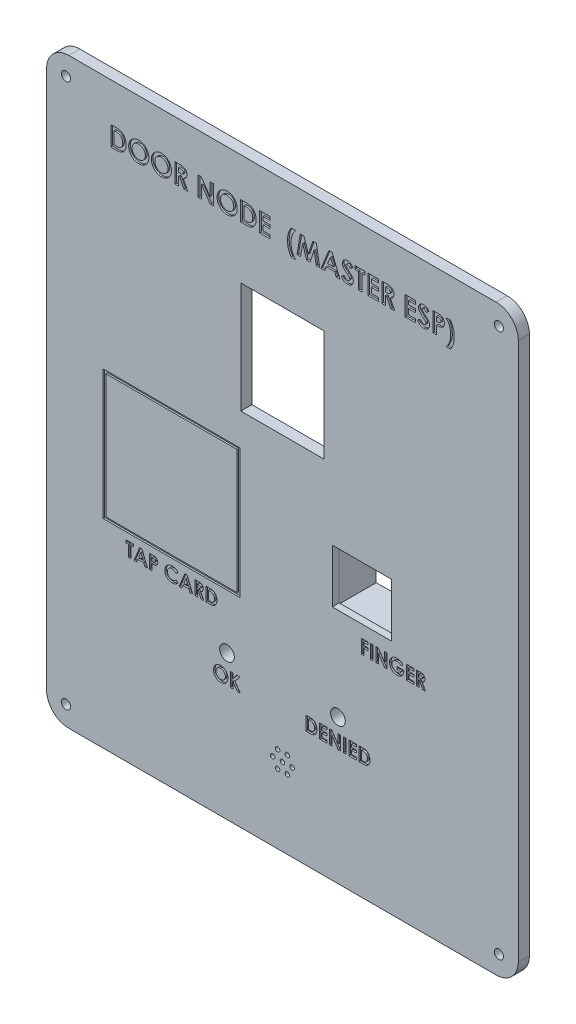
from build123d import *

# Parameters (mm, degrees)
PANEL_DEPTH                    = 4
SKETCH2_R                      = 1.65
SCREW_HOLES_DEPTH              = 227.585524692
SKETCH3_W                      = 30
SKETCH3_H                      = 2
SKETCH3_W_2                    = 2
SKETCH3_H_2                    = 30
LOCATING_TABS_DEPTH            = 3
SKETCH4_W                      = 30
SKETCH4_H                      = 40
TFT_WINDOW_DEPTH               = 227.585524692
SKETCH5_R                      = 2.1
TFT_BOSSES_DEPTH               = 2.4
SKETCH6_R                      = 1.1
TFT_PILOT_HOLES_DEPTH          = 4
SKETCH7_W                      = 43.3
SKETCH7_H                      = 40.7
SKETCH7_R                      = 3
NFC_POCKET_DEPTH               = 2.5
SKETCH8_R                      = 1.1
NFC_PILOT_HOLES_DEPTH          = 3
SKETCH9_W                      = 49.3
SKETCH9_H                      = 46.7
NFC_TAP_OUTLINE_RECESS_DEPTH   = 0.6
SKETCH10_W                     = 47.3
SKETCH10_H                     = 44.7
NFC_TAP_OUTLINE_FILL_DEPTH     = 0.6
SKETCH11_W                     = 44.4
SKETCH11_H                     = 20.3
FINGERPRINT_POCKET_DEPTH       = 1.5
SKETCH12_W                     = 21.3
SKETCH12_H                     = 19.3
FINGERPRINT_APERTURE_DEPTH     = 227.585524692
SKETCH13_W                     = 46.4
SKETCH13_H                     = 2
FINGERPRINT_CRADLE_SIDES_DEPTH = 12
SKETCH14_W                     = 2
SKETCH14_H                     = 20.3
FINGERPRINT_CRADLE_END_DEPTH   = 12
SKETCH15_W                     = 4
SKETCH15_H                     = 2.5
FINGERPRINT_TIE_SLOTS_DEPTH    = 139.077595938
SKETCH16_R                     = 2.65
LED_HOLES_DEPTH                = 227.867802916
SKETCH17_R                     = 0.8
BUZZER_SOUND_HOLES_DEPTH       = 227.867802916
SKETCH18_R                     = 7.75
SKETCH18_R_2                   = 6.15
BUZZER_CRADLE_DEPTH            = 7
SKETCH19_W                     = 0.897435897
SKETCH19_H                     = 5
SKETCH19_W_2                   = 0.897435898
LABELS_ENGRAVED_DEPTH          = 0.6


with BuildPart() as part:
    # Sketch1 → Panel (new body)
    with BuildSketch(Plane.XY):
        with BuildLine():
            Line((-77, 0), (77, 0))
            ThreePointArc((77, 0), (82.656854249, 2.343145751), (85, 8))
            Line((85, 8), (85, 202))
            ThreePointArc((85, 202), (82.656854249, 207.656854249), (77, 210))
            Line((77, 210), (-77, 210))
            ThreePointArc((-77, 210), (-82.656854249, 207.656854249), (-85, 202))
            Line((-85, 202), (-85, 8))
            ThreePointArc((-85, 8), (-82.656854249, 2.343145751), (-77, 0))
        make_face()
    extrude(amount=PANEL_DEPTH)

    # Sketch2 → Screw holes (cut, through all)
    with BuildSketch(Plane.XY):
        with Locations((-78, 7)):
            Circle(SKETCH2_R)
        with Locations((78, 7)):
            Circle(SKETCH2_R)
        with Locations((-78, 203)):
            Circle(SKETCH2_R)
        with Locations((78, 203)):
            Circle(SKETCH2_R)
    extrude(amount=SCREW_HOLES_DEPTH, mode=Mode.SUBTRACT)

    # Sketch3 → Locating tabs (add)
    with BuildSketch(Plane.XY.offset(-3)):
        with Locations((0, 4.3)):
            Rectangle(SKETCH3_W, SKETCH3_H)
        with Locations((0, 205.7)):
            Rectangle(SKETCH3_W, SKETCH3_H)
        with Locations((-80.7, 105)):
            Rectangle(SKETCH3_W_2, SKETCH3_H_2)
        with Locations((80.7, 105)):
            Rectangle(SKETCH3_W_2, SKETCH3_H_2)
    extrude(amount=LOCATING_TABS_DEPTH)

    # Sketch4 → TFT window (cut, through all)
    with BuildSketch(Plane.XY):
        with Locations((0, 150)):
            Rectangle(SKETCH4_W, SKETCH4_H)
    extrude(amount=TFT_WINDOW_DEPTH, mode=Mode.SUBTRACT)

    # Sketch5 → TFT bosses (add)
    with BuildSketch(Plane.XY.offset(-2.4)):
        with Locations((-14.25, 124)):
            Circle(SKETCH5_R)
        with Locations((-14.25, 176)):
            Circle(SKETCH5_R)
        with Locations((14.25, 124)):
            Circle(SKETCH5_R)
        with Locations((14.25, 176)):
            Circle(SKETCH5_R)
    extrude(amount=TFT_BOSSES_DEPTH)

    # Sketch6 → TFT pilot holes (cut)
    with BuildSketch(Plane.XY.offset(-2.4)):
        with Locations((-14.25, 124)):
            Circle(SKETCH6_R)
        with Locations((-14.25, 176)):
            Circle(SKETCH6_R)
        with Locations((14.25, 124)):
            Circle(SKETCH6_R)
        with Locations((14.25, 176)):
            Circle(SKETCH6_R)
    extrude(amount=TFT_PILOT_HOLES_DEPTH, mode=Mode.SUBTRACT)

    # Sketch7 → NFC pocket (cut)
    with BuildSketch(Plane.XY):
        with Locations((-40, 95)):
            Rectangle(SKETCH7_W, SKETCH7_H)
        with Locations((-53.9, 82.4)):
            Circle(SKETCH7_R, mode=Mode.SUBTRACT)
        with Locations((-53.9, 107.6)):
            Circle(SKETCH7_R, mode=Mode.SUBTRACT)
        with Locations((-26.1, 82.4)):
            Circle(SKETCH7_R, mode=Mode.SUBTRACT)
        with Locations((-26.1, 107.6)):
            Circle(SKETCH7_R, mode=Mode.SUBTRACT)
    extrude(amount=NFC_POCKET_DEPTH, mode=Mode.SUBTRACT)

    # Sketch8 → NFC pilot holes (cut)
    with BuildSketch(Plane.XY):
        with Locations((-53.9, 82.4)):
            Circle(SKETCH8_R)
        with Locations((-53.9, 107.6)):
            Circle(SKETCH8_R)
        with Locations((-26.1, 82.4)):
            Circle(SKETCH8_R)
        with Locations((-26.1, 107.6)):
            Circle(SKETCH8_R)
    extrude(amount=NFC_PILOT_HOLES_DEPTH, mode=Mode.SUBTRACT)

    # Sketch9 → NFC tap outline recess (cut)
    with BuildSketch(Plane.XY.offset(4)):
        with Locations((-40, 95)):
            Rectangle(SKETCH9_W, SKETCH9_H)
    extrude(amount=-NFC_TAP_OUTLINE_RECESS_DEPTH, mode=Mode.SUBTRACT)

    # Sketch10 → NFC tap outline fill (add)
    with BuildSketch(Plane.XY.offset(3.4)):
        with Locations((-40, 95)):
            Rectangle(SKETCH10_W, SKETCH10_H)
    extrude(amount=NFC_TAP_OUTLINE_FILL_DEPTH)

    # Sketch11 → Fingerprint pocket (cut)
    with BuildSketch(Plane.XY):
        with Locations((40, 95)):
            Rectangle(SKETCH11_W, SKETCH11_H)
    extrude(amount=FINGERPRINT_POCKET_DEPTH, mode=Mode.SUBTRACT)

    # Sketch12 → Fingerprint aperture (cut, through all)
    with BuildSketch(Plane.XY):
        with Locations((28.6, 95)):
            Rectangle(SKETCH12_W, SKETCH12_H)
    extrude(amount=FINGERPRINT_APERTURE_DEPTH, mode=Mode.SUBTRACT)

    # Sketch13 → Fingerprint cradle sides (add)
    with BuildSketch(Plane.XY.offset(-12)):
        with Locations((39, 106.15)):
            Rectangle(SKETCH13_W, SKETCH13_H)
        with Locations((39, 83.85)):
            Rectangle(SKETCH13_W, SKETCH13_H)
    extrude(amount=FINGERPRINT_CRADLE_SIDES_DEPTH)

    # Sketch14 → Fingerprint cradle end (add)
    with BuildSketch(Plane.XY.offset(-12)):
        with Locations((16.8, 95)):
            Rectangle(SKETCH14_W, SKETCH14_H)
    extrude(amount=FINGERPRINT_CRADLE_END_DEPTH)

    # Sketch15 → Fingerprint tie slots (cut, through all)
    with BuildSketch(Plane(origin=(0, 108.15, 0), x_dir=(1, 0, 0), z_dir=(0, 1, 0))):
        with Locations((30, 9.25)):
            Rectangle(SKETCH15_W, SKETCH15_H)
        with Locations((50, 9.25)):
            Rectangle(SKETCH15_W, SKETCH15_H)
    extrude(amount=-FINGERPRINT_TIE_SLOTS_DEPTH, mode=Mode.SUBTRACT)

    # Sketch16 → LED holes (cut, through all)
    with BuildSketch(Plane.XY):
        with Locations((-20, 52)):
            Circle(SKETCH16_R)
        with Locations((20, 52)):
            Circle(SKETCH16_R)
    extrude(amount=LED_HOLES_DEPTH, mode=Mode.SUBTRACT)

    # Sketch17 → Buzzer sound holes (cut, through all)
    with BuildSketch(Plane.XY):
        with Locations((0, 28)):
            Circle(SKETCH17_R)
        with Locations((3.5, 28)):
            Circle(SKETCH17_R)
        with Locations((1.75, 31.031088913)):
            Circle(SKETCH17_R)
        with Locations((-1.75, 31.031088913)):
            Circle(SKETCH17_R)
        with Locations((-3.5, 28)):
            Circle(SKETCH17_R)
        with Locations((-1.75, 24.968911087)):
            Circle(SKETCH17_R)
        with Locations((1.75, 24.968911087)):
            Circle(SKETCH17_R)
    extrude(amount=BUZZER_SOUND_HOLES_DEPTH, mode=Mode.SUBTRACT)

    # Sketch18 → Buzzer cradle (add)
    with BuildSketch(Plane.XY.offset(-7)):
        with Locations((0, 28)):
            Circle(SKETCH18_R)
        with Locations((0, 28)):
            Circle(SKETCH18_R_2, mode=Mode.SUBTRACT)
    extrude(amount=BUZZER_CRADLE_DEPTH)

    # Sketch19 → Labels (engraved) (cut)
    # profile 1 of 40: a face of its own
    with BuildSketch(Plane.XY.offset(4)):
        with BuildLine():
            Line((-61.878205128, 196), (-60.295072115, 196))
            add(Edge.make_bspline(
                [(-60.295072115, 196), (-60.171648688, 195.999137228), (-59.933069807, 195.99746948), (-59.587416207, 195.97867797), (-59.266002345, 195.949777963), (-58.96862103, 195.910020765), (-58.695881942, 195.857411104), (-58.448136773, 195.791422597), (-58.224554031, 195.715249843), (-58.022682176, 195.625617141), (-57.83839259, 195.521114312), (-57.663403746, 195.404706551), (-57.498059231, 195.2721295), (-57.340038697, 195.125940836), (-57.191381431, 194.963466082), (-57.049611757, 194.787396408), (-56.918200842, 194.595178561), (-56.793176416, 194.391421319), (-56.680108459, 194.175261178), (-56.581486362, 193.948538048), (-56.498870033, 193.712710978), (-56.431739988, 193.467528636), (-56.378229595, 193.213804954), (-56.340789451, 192.951027941), (-56.317643581, 192.679440884), (-56.315295626, 192.495373), (-56.314102564, 192.401842949)],
                knots=[0, 0, 0, 0, 1.44355588, 2.790409838, 4.047694926, 5.217575253, 6.298404546, 7.294384826, 8.214239204, 9.058592145, 9.873746385, 10.689560431, 11.514393297, 12.350027578, 13.205127629, 14.088021785, 14.991911688, 15.926770944, 16.882954281, 17.842803888, 18.816321264, 19.80318086, 20.814351908, 21.847355356, 22.906180909, 24, 24, 24, 24], degree=3))
            add(Edge.make_bspline(
                [(-56.314102564, 192.401842949), (-56.317226644, 192.269865958), (-56.323376578, 192.010061526), (-56.375180185, 191.628801515), (-56.458964158, 191.263325768), (-56.576772035, 190.916493178), (-56.722822265, 190.591392341), (-56.897295619, 190.293756274), (-57.097633912, 190.025182535), (-57.321503191, 189.787008403), (-57.563899097, 189.582294508), (-57.815797323, 189.406972038), (-58.079651816, 189.268715641), (-58.312144499, 189.181040411), (-58.51374466, 189.126514003), (-58.690747421, 189.09428837), (-58.891804497, 189.064735522), (-59.118790571, 189.041897717), (-59.370709904, 189.021532006), (-59.648566649, 189.010466072), (-59.951461187, 189.001271924), (-60.161850083, 189.000435084), (-60.271233974, 189)],
                knots=[0, 0, 0, 0, 1.315458931, 2.589557908, 3.828601765, 5.048913369, 6.235739168, 7.376350998, 8.481830359, 9.569842114, 10.627874879, 11.640079404, 12.624025415, 13.590060155, 14.111227486, 14.704434459, 15.382649715, 16.137166398, 16.978595427, 17.902333227, 18.909396075, 20, 20, 20, 20], degree=3))
            Line((-60.271233974, 189), (-61.878205128, 189))
            Line((-61.878205128, 189), (-61.878205128, 196))
        make_face()
        with BuildLine():
            Line((-60.621794872, 194.743589744), (-60.621794872, 190.256410256))
            Line((-60.621794872, 190.256410256), (-59.965544872, 190.256410256))
            add(Edge.make_bspline(
                [(-59.965544872, 190.256410256), (-59.8874612, 190.256553338), (-59.737280306, 190.256828532), (-59.520453089, 190.269936239), (-59.319942892, 190.283092763), (-59.136301671, 190.308064285), (-58.968192945, 190.335880803), (-58.817926085, 190.374591297), (-58.682403439, 190.415253392), (-58.563280391, 190.467021279), (-58.454173385, 190.52528948), (-58.35315276, 190.593557434), (-58.255639573, 190.669366421), (-58.163456912, 190.754946093), (-58.076255888, 190.849163213), (-57.994552437, 190.952503241), (-57.917256034, 191.064650884), (-57.846350732, 191.186199093), (-57.781557088, 191.315864292), (-57.724077865, 191.452390485), (-57.676419107, 191.596914641), (-57.636808066, 191.748083839), (-57.608501485, 191.907214179), (-57.585083188, 192.073127006), (-57.573010374, 192.246479651), (-57.571353456, 192.364434585), (-57.570512821, 192.424278846)],
                knots=[0, 0, 0, 0, 1.50275155, 2.890291501, 4.180787663, 5.369391935, 6.45668281, 7.458360028, 8.354766181, 9.177074746, 9.954075863, 10.732690366, 11.5210699, 12.329727389, 13.151100085, 13.990027547, 14.863562427, 15.770965086, 16.696477834, 17.652329173, 18.619756807, 19.62365428, 20.657822005, 21.729286259, 22.847956731, 24, 24, 24, 24], degree=3))
            add(Edge.make_bspline(
                [(-57.570512821, 192.424278846), (-57.57218708, 192.51598452), (-57.575451757, 192.694803477), (-57.606935596, 192.955257193), (-57.658185278, 193.200513383), (-57.731313638, 193.429661837), (-57.823494201, 193.643346583), (-57.938879664, 193.839757258), (-58.072504281, 194.02219329), (-58.178170982, 194.129216121), (-58.230969551, 194.182692308)],
                knots=[0, 0, 0, 0, 1.13821349, 2.219428113, 3.251817212, 4.244760574, 5.201143372, 6.134805572, 7.068016741, 8, 8, 8, 8], degree=3))
            add(Edge.make_bspline(
                [(-58.230969551, 194.182692308), (-58.28303394, 194.228261248), (-58.389369557, 194.32133065), (-58.576059959, 194.432851594), (-58.781783112, 194.530833674), (-59.011245346, 194.608522537), (-59.26222901, 194.669962201), (-59.536228969, 194.712335635), (-59.831777893, 194.739564355), (-60.036527301, 194.742219201), (-60.142227564, 194.743589744)],
                knots=[0, 0, 0, 0, 0.813307809, 1.661089106, 2.549956539, 3.493439533, 4.508053171, 5.589449661, 6.755572447, 8, 8, 8, 8], degree=3))
            Line((-60.142227564, 194.743589744), (-60.621794872, 194.743589744))
        make_face(mode=Mode.SUBTRACT)
    # profile 2 of 40: a face of its own
    with BuildSketch(Plane.XY.offset(4)):
        with BuildLine():
            add(Edge.make_bspline(
                [(-51.768028846, 196.179487179), (-51.646325267, 196.176336056), (-51.406054837, 196.170115024), (-51.052703739, 196.11825787), (-50.712184621, 196.033764071), (-50.384651466, 195.916311579), (-50.070924379, 195.762719183), (-49.76989674, 195.57734133), (-49.482646814, 195.356679122), (-49.212118109, 195.105880246), (-48.962100795, 194.833147419), (-48.745460646, 194.539502043), (-48.560717875, 194.232552764), (-48.407602572, 193.911477103), (-48.29097677, 193.574051457), (-48.20913562, 193.221996252), (-48.156556736, 192.855411644), (-48.150509356, 192.605817493), (-48.147435897, 192.478966346)],
                knots=[0, 0, 0, 0, 1.014329547, 2.002516266, 2.970391464, 3.935626869, 4.897733899, 5.877609409, 6.878433252, 7.912639331, 8.949961323, 9.958554974, 10.949718813, 11.932905612, 12.9188844, 13.919928257, 14.942845884, 16, 16, 16, 16], degree=3))
            add(Edge.make_bspline(
                [(-48.147435897, 192.478966346), (-48.150708997, 192.353544519), (-48.157158746, 192.106396785), (-48.20698912, 191.743190399), (-48.290208485, 191.394906439), (-48.404856222, 191.060756556), (-48.555194593, 190.742359259), (-48.736334678, 190.437681624), (-48.953056422, 190.149551132), (-49.197455132, 189.878122407), (-49.4665169, 189.631742596), (-49.751496027, 189.414620814), (-50.051076653, 189.230640009), (-50.364820288, 189.079884454), (-50.693399741, 188.962888619), (-51.036003381, 188.880339557), (-51.392610006, 188.830172825), (-51.635119804, 188.823765206), (-51.758213141, 188.820512821)],
                knots=[0, 0, 0, 0, 1.051557043, 2.072126891, 3.067553643, 4.050577992, 5.02905126, 6.015227836, 7.017913613, 8.04756643, 9.074058332, 10.072836633, 11.047628519, 12.017157415, 12.98668631, 13.966869689, 14.968021931, 16, 16, 16, 16], degree=3))
            add(Edge.make_bspline(
                [(-51.758213141, 188.820512821), (-51.886954012, 188.82343037), (-52.139912225, 188.829162956), (-52.510117702, 188.883677235), (-52.864806538, 188.965794782), (-53.200999142, 189.088350815), (-53.522119348, 189.241556163), (-53.825807792, 189.430237733), (-54.111962415, 189.654083716), (-54.378941786, 189.907361332), (-54.620825743, 190.184502596), (-54.83433578, 190.477277765), (-55.014436234, 190.783450294), (-55.161133692, 191.103163478), (-55.276784075, 191.434430378), (-55.35836228, 191.779268505), (-55.406552472, 192.136850811), (-55.413265086, 192.379727861), (-55.416666667, 192.502804487)],
                knots=[0, 0, 0, 0, 1.067978421, 2.098431617, 3.099715153, 4.085208694, 5.062210972, 6.048429807, 7.046490867, 8.072918869, 9.098532598, 10.095778865, 11.076610158, 12.041847152, 13.011192615, 13.984257998, 14.978533688, 16, 16, 16, 16], degree=3))
            add(Edge.make_bspline(
                [(-55.416666667, 192.502804487), (-55.415599055, 192.585603998), (-55.413477349, 192.750154589), (-55.387919171, 192.994010164), (-55.351122743, 193.233106006), (-55.296702571, 193.466488836), (-55.230595972, 193.695805061), (-55.144945534, 193.918920149), (-55.047452157, 194.138217583), (-54.933540326, 194.351107186), (-54.806881383, 194.555630195), (-54.668685201, 194.750821839), (-54.518604285, 194.934321967), (-54.357122096, 195.107336465), (-54.183682145, 195.268728097), (-54.000565856, 195.420781585), (-53.804221838, 195.55945785), (-53.598947446, 195.68814364), (-53.38589997, 195.804511969), (-53.165946706, 195.90356121), (-52.943619127, 195.990059226), (-52.715947234, 196.058327284), (-52.485370939, 196.113930903), (-52.249426999, 196.150702531), (-52.010247036, 196.176260001), (-51.848959853, 196.1784089), (-51.768028846, 196.179487179)],
                knots=[0, 0, 0, 0, 1.034744296, 2.056386356, 3.06226378, 4.057406941, 5.050368692, 6.043467995, 7.042652155, 8.049140477, 9.059438543, 10.048523776, 11.036952808, 12.020949711, 13.004946614, 13.997082645, 14.994316842, 16.007702937, 17.024872941, 18.026463647, 19.021641123, 20.005082605, 20.995858141, 21.984425357, 22.988620895, 24, 24, 24, 24], degree=3))
        make_face()
        with BuildLine():
            add(Edge.make_bspline(
                [(-51.787660256, 194.923076923), (-51.869566749, 194.920879188), (-52.031217389, 194.916541738), (-52.268329439, 194.883496239), (-52.495965381, 194.83071882), (-52.712863338, 194.754271373), (-52.919963366, 194.656973176), (-53.117632588, 194.539164201), (-53.303133694, 194.396794894), (-53.478940162, 194.237508431), (-53.637752377, 194.060026704), (-53.778067979, 193.86982485), (-53.895489537, 193.667220503), (-53.993830828, 193.454095808), (-54.067860025, 193.228054236), (-54.120588802, 192.990866394), (-54.153911421, 192.742123597), (-54.158111778, 192.572555955), (-54.16025641, 192.485977564)],
                knots=[0, 0, 0, 0, 1.033739768, 2.040188636, 3.016340934, 3.979330865, 4.937572243, 5.900995986, 6.878200029, 7.884839167, 8.891893314, 9.879764717, 10.863503415, 11.843163062, 12.837761627, 13.859916423, 14.907309254, 16, 16, 16, 16], degree=3))
            add(Edge.make_bspline(
                [(-54.16025641, 192.485977564), (-54.157412956, 192.390029231), (-54.151840256, 192.201986397), (-54.112630061, 191.927674577), (-54.045545321, 191.668614288), (-53.948676261, 191.426072556), (-53.828533212, 191.197356136), (-53.679334613, 190.985268273), (-53.503496776, 190.788539084), (-53.36803273, 190.673680389), (-53.299278846, 190.615384615)],
                knots=[0, 0, 0, 0, 1.078454662, 2.113592447, 3.107694534, 4.079536787, 5.043276885, 6.005368276, 6.987637804, 8, 8, 8, 8], degree=3))
            add(Edge.make_bspline(
                [(-53.299278846, 190.615384615), (-53.242956289, 190.572317936), (-53.131580132, 190.487154878), (-52.953799536, 190.378000948), (-52.770720529, 190.284445142), (-52.580961551, 190.208853157), (-52.384923361, 190.149393772), (-52.182632844, 190.107755343), (-51.974376628, 190.081623627), (-51.833544014, 190.078500392), (-51.762419872, 190.076923077)],
                knots=[0, 0, 0, 0, 1.023928204, 2.024787132, 3.009472467, 3.9914905, 4.972207045, 5.96565515, 6.972602802, 8, 8, 8, 8], degree=3))
            add(Edge.make_bspline(
                [(-51.762419872, 190.076923077), (-51.681921763, 190.079139446), (-51.523539203, 190.083500223), (-51.290841122, 190.116138914), (-51.067909293, 190.171375364), (-50.853359736, 190.247152187), (-50.647811116, 190.345672047), (-50.452268005, 190.467135087), (-50.266387563, 190.610049899), (-50.09080507, 190.771428142), (-49.930314371, 190.949609024), (-49.790291579, 191.140825395), (-49.669136601, 191.340864187), (-49.572840319, 191.552556644), (-49.495886396, 191.773904489), (-49.443792238, 192.005888025), (-49.410188118, 192.247550926), (-49.405986577, 192.412011071), (-49.403846154, 192.495793269)],
                knots=[0, 0, 0, 0, 1.026359118, 2.019393844, 2.989460624, 3.950973911, 4.916101784, 5.890408035, 6.881132271, 7.902007068, 8.92769091, 9.933912415, 10.920395702, 11.90457117, 12.894218921, 13.903490204, 14.931958862, 16, 16, 16, 16], degree=3))
            add(Edge.make_bspline(
                [(-49.403846154, 192.495793269), (-49.406060636, 192.579093697), (-49.410419507, 192.743057885), (-49.443115644, 192.984099473), (-49.498001799, 193.215058869), (-49.574006171, 193.436313255), (-49.67105973, 193.648079541), (-49.791076301, 193.849613034), (-49.933634762, 194.040718898), (-50.095454137, 194.22009482), (-50.271584581, 194.384929803), (-50.460678212, 194.527976604), (-50.657443977, 194.652279726), (-50.866396644, 194.749653772), (-51.083261215, 194.827231469), (-51.309361009, 194.884360798), (-51.545552394, 194.916309592), (-51.706238277, 194.920801039), (-51.787660256, 194.923076923)],
                knots=[0, 0, 0, 0, 1.055025985, 2.07665775, 3.074803781, 4.057872707, 5.035505728, 6.020516407, 7.023567878, 8.050795229, 9.077271434, 10.074415901, 11.050397877, 12.019801805, 12.988065821, 13.964604439, 14.968634123, 16, 16, 16, 16], degree=3))
        make_face(mode=Mode.SUBTRACT)
    # profile 3 of 40: a face of its own
    with BuildSketch(Plane.XY.offset(4)):
        with BuildLine():
            add(Edge.make_bspline(
                [(-43.601362179, 196.179487179), (-43.479658601, 196.176336056), (-43.23938817, 196.170115024), (-42.886037072, 196.11825787), (-42.545517955, 196.033764071), (-42.2179848, 195.916311579), (-41.904257713, 195.762719183), (-41.603230073, 195.57734133), (-41.315980147, 195.356679122), (-41.045451442, 195.105880246), (-40.795434128, 194.833147419), (-40.57879398, 194.539502043), (-40.394051209, 194.232552764), (-40.240935906, 193.911477103), (-40.124310103, 193.574051457), (-40.042468953, 193.221996252), (-39.989890069, 192.855411644), (-39.983842689, 192.605817493), (-39.980769231, 192.478966346)],
                knots=[0, 0, 0, 0, 1.014329547, 2.002516266, 2.970391464, 3.935626869, 4.897733899, 5.877609409, 6.878433252, 7.912639331, 8.949961323, 9.958554974, 10.949718813, 11.932905612, 12.9188844, 13.919928257, 14.942845884, 16, 16, 16, 16], degree=3))
            add(Edge.make_bspline(
                [(-39.980769231, 192.478966346), (-39.984042331, 192.353544519), (-39.990492079, 192.106396785), (-40.040322453, 191.743190399), (-40.123541818, 191.394906439), (-40.238189556, 191.060756556), (-40.388527926, 190.742359259), (-40.569668012, 190.437681624), (-40.786389756, 190.149551132), (-41.030788465, 189.878122407), (-41.299850234, 189.631742596), (-41.58482936, 189.414620814), (-41.884409986, 189.230640009), (-42.198153622, 189.079884454), (-42.526733075, 188.962888619), (-42.869336714, 188.880339557), (-43.225943339, 188.830172825), (-43.468453138, 188.823765206), (-43.591546474, 188.820512821)],
                knots=[0, 0, 0, 0, 1.051557043, 2.072126891, 3.067553643, 4.050577992, 5.02905126, 6.015227836, 7.017913613, 8.04756643, 9.074058332, 10.072836633, 11.047628519, 12.017157415, 12.98668631, 13.966869689, 14.968021931, 16, 16, 16, 16], degree=3))
            add(Edge.make_bspline(
                [(-43.591546474, 188.820512821), (-43.720287345, 188.82343037), (-43.973245558, 188.829162956), (-44.343451036, 188.883677235), (-44.698139872, 188.965794782), (-45.034332476, 189.088350815), (-45.355452682, 189.241556163), (-45.659141126, 189.430237733), (-45.945295748, 189.654083716), (-46.212275119, 189.907361332), (-46.454159076, 190.184502596), (-46.667669114, 190.477277765), (-46.847769567, 190.783450294), (-46.994467025, 191.103163478), (-47.110117408, 191.434430378), (-47.191695613, 191.779268505), (-47.239885805, 192.136850811), (-47.246598419, 192.379727861), (-47.25, 192.502804487)],
                knots=[0, 0, 0, 0, 1.067978421, 2.098431617, 3.099715153, 4.085208694, 5.062210972, 6.048429807, 7.046490867, 8.072918869, 9.098532598, 10.095778865, 11.076610158, 12.041847152, 13.011192615, 13.984257998, 14.978533688, 16, 16, 16, 16], degree=3))
            add(Edge.make_bspline(
                [(-47.25, 192.502804487), (-47.248932388, 192.585603998), (-47.246810682, 192.750154589), (-47.221252504, 192.994010164), (-47.184456076, 193.233106006), (-47.130035904, 193.466488836), (-47.063929305, 193.695805061), (-46.978278868, 193.918920149), (-46.880785491, 194.138217583), (-46.766873659, 194.351107186), (-46.640214717, 194.555630195), (-46.502018534, 194.750821839), (-46.351937618, 194.934321967), (-46.190455429, 195.107336465), (-46.017015479, 195.268728097), (-45.833899189, 195.420781585), (-45.637555171, 195.55945785), (-45.43228078, 195.68814364), (-45.219233303, 195.804511969), (-44.99928004, 195.90356121), (-44.77695246, 195.990059226), (-44.549280568, 196.058327284), (-44.318704272, 196.113930903), (-44.082760333, 196.150702531), (-43.843580369, 196.176260001), (-43.682293187, 196.1784089), (-43.601362179, 196.179487179)],
                knots=[0, 0, 0, 0, 1.034744296, 2.056386356, 3.06226378, 4.057406941, 5.050368692, 6.043467995, 7.042652155, 8.049140477, 9.059438543, 10.048523776, 11.036952808, 12.020949711, 13.004946614, 13.997082645, 14.994316842, 16.007702937, 17.024872941, 18.026463647, 19.021641123, 20.005082605, 20.995858141, 21.984425357, 22.988620895, 24, 24, 24, 24], degree=3))
        make_face()
        with BuildLine():
            add(Edge.make_bspline(
                [(-43.62099359, 194.923076923), (-43.702900082, 194.920879188), (-43.864550722, 194.916541738), (-44.101662773, 194.883496239), (-44.329298714, 194.83071882), (-44.546196672, 194.754271373), (-44.753296699, 194.656973176), (-44.950965921, 194.539164201), (-45.136467027, 194.396794894), (-45.312273496, 194.237508431), (-45.47108571, 194.060026704), (-45.611401312, 193.86982485), (-45.728822871, 193.667220503), (-45.827164162, 193.454095808), (-45.901193358, 193.228054236), (-45.953922135, 192.990866394), (-45.987244754, 192.742123597), (-45.991445112, 192.572555955), (-45.993589744, 192.485977564)],
                knots=[0, 0, 0, 0, 1.033739768, 2.040188636, 3.016340934, 3.979330865, 4.937572243, 5.900995986, 6.878200029, 7.884839167, 8.891893314, 9.879764717, 10.863503415, 11.843163062, 12.837761627, 13.859916423, 14.907309254, 16, 16, 16, 16], degree=3))
            add(Edge.make_bspline(
                [(-45.993589744, 192.485977564), (-45.990746289, 192.390029231), (-45.985173589, 192.201986397), (-45.945963394, 191.927674577), (-45.878878654, 191.668614288), (-45.782009594, 191.426072556), (-45.661866545, 191.197356136), (-45.512667947, 190.985268273), (-45.336830109, 190.788539084), (-45.201366064, 190.673680389), (-45.132612179, 190.615384615)],
                knots=[0, 0, 0, 0, 1.078454662, 2.113592447, 3.107694534, 4.079536787, 5.043276885, 6.005368276, 6.987637804, 8, 8, 8, 8], degree=3))
            add(Edge.make_bspline(
                [(-45.132612179, 190.615384615), (-45.076289622, 190.572317936), (-44.964913465, 190.487154878), (-44.78713287, 190.378000948), (-44.604053863, 190.284445142), (-44.414294884, 190.208853157), (-44.218256695, 190.149393772), (-44.015966177, 190.107755343), (-43.807709961, 190.081623627), (-43.666877347, 190.078500392), (-43.595753205, 190.076923077)],
                knots=[0, 0, 0, 0, 1.023928204, 2.024787132, 3.009472467, 3.9914905, 4.972207045, 5.96565515, 6.972602802, 8, 8, 8, 8], degree=3))
            add(Edge.make_bspline(
                [(-43.595753205, 190.076923077), (-43.515255097, 190.079139446), (-43.356872537, 190.083500223), (-43.124174456, 190.116138914), (-42.901242626, 190.171375364), (-42.686693069, 190.247152187), (-42.481144449, 190.345672047), (-42.285601338, 190.467135087), (-42.099720896, 190.610049899), (-41.924138403, 190.771428142), (-41.763647704, 190.949609024), (-41.623624912, 191.140825395), (-41.502469935, 191.340864187), (-41.406173652, 191.552556644), (-41.32921973, 191.773904489), (-41.277125571, 192.005888025), (-41.243521452, 192.247550926), (-41.239319911, 192.412011071), (-41.237179487, 192.495793269)],
                knots=[0, 0, 0, 0, 1.026359118, 2.019393844, 2.989460624, 3.950973911, 4.916101784, 5.890408035, 6.881132271, 7.902007068, 8.92769091, 9.933912415, 10.920395702, 11.90457117, 12.894218921, 13.903490204, 14.931958862, 16, 16, 16, 16], degree=3))
            add(Edge.make_bspline(
                [(-41.237179487, 192.495793269), (-41.23939397, 192.579093697), (-41.24375284, 192.743057885), (-41.276448978, 192.984099473), (-41.331335132, 193.215058869), (-41.407339505, 193.436313255), (-41.504393063, 193.648079541), (-41.624409635, 193.849613034), (-41.766968095, 194.040718898), (-41.92878747, 194.22009482), (-42.104917915, 194.384929803), (-42.294011546, 194.527976604), (-42.490777311, 194.652279726), (-42.699729977, 194.749653772), (-42.916594548, 194.827231469), (-43.142694342, 194.884360798), (-43.378885727, 194.916309592), (-43.53957161, 194.920801039), (-43.62099359, 194.923076923)],
                knots=[0, 0, 0, 0, 1.055025985, 2.07665775, 3.074803781, 4.057872707, 5.035505728, 6.020516407, 7.023567878, 8.050795229, 9.077271434, 10.074415901, 11.050397877, 12.019801805, 12.988065821, 13.964604439, 14.968634123, 16, 16, 16, 16], degree=3))
        make_face(mode=Mode.SUBTRACT)
    # profile 4 of 40: a face of its own
    with BuildSketch(Plane.XY.offset(4)):
        with BuildLine():
            Line((-38.724358974, 196), (-37.260416667, 196))
            add(Edge.make_bspline(
                [(-37.260416667, 196), (-37.163650526, 195.999656536), (-36.977541979, 195.998995957), (-36.70918362, 195.988573778), (-36.462659562, 195.97407046), (-36.237604804, 195.951938011), (-36.034115627, 195.92259306), (-35.851988089, 195.888000219), (-35.691227513, 195.848574259), (-35.550478104, 195.799446403), (-35.423458723, 195.744030927), (-35.305059001, 195.680357528), (-35.192666864, 195.60913523), (-35.087033531, 195.528489982), (-34.987241025, 195.439872572), (-34.893101081, 195.343193798), (-34.805943984, 195.237633864), (-34.726309413, 195.123859774), (-34.653728912, 195.00417204), (-34.589582972, 194.878406331), (-34.537419387, 194.746475184), (-34.491327268, 194.610285291), (-34.458128607, 194.467889789), (-34.435039425, 194.320674922), (-34.418134429, 194.16812248), (-34.417162472, 194.064485124), (-34.416666667, 194.01161859)],
                knots=[0, 0, 0, 0, 1.749336639, 3.364467119, 4.854658419, 6.213483162, 7.451590619, 8.570285859, 9.5643256, 10.440900261, 11.26203566, 12.067320669, 12.869050712, 13.665104639, 14.467235401, 15.27997916, 16.102287765, 16.939272006, 17.78853747, 18.631303466, 19.488103222, 20.351255419, 21.228522269, 22.127379805, 23.044756219, 24, 24, 24, 24], degree=3))
            add(Edge.make_bspline(
                [(-34.416666667, 194.01161859), (-34.417954591, 193.956438073), (-34.420479976, 193.848239136), (-34.434083073, 193.689303722), (-34.458945261, 193.537245435), (-34.496602662, 193.392509483), (-34.539884954, 193.253294458), (-34.597439299, 193.122168965), (-34.662395066, 192.997225972), (-34.739541132, 192.880232847), (-34.824205171, 192.768590938), (-34.922667667, 192.666577661), (-35.028549764, 192.568710188), (-35.147803479, 192.481118607), (-35.275171997, 192.397880289), (-35.413185998, 192.322444207), (-35.560944754, 192.252914069), (-35.664826478, 192.214139262), (-35.717948718, 192.194310897)],
                knots=[0, 0, 0, 0, 1.099860209, 2.156625411, 3.176576793, 4.16617041, 5.135385252, 6.078461593, 7.016046972, 7.938469504, 8.868247731, 9.803980173, 10.76021508, 11.73834243, 12.748633912, 13.790971185, 14.870363756, 16, 16, 16, 16], degree=3))
            Line((-35.717948718, 192.194310897), (-34.102564103, 189))
            Line((-34.102564103, 189), (-35.499198718, 189))
            Line((-35.499198718, 189), (-37.041666667, 192.051282051))
            Line((-37.041666667, 192.051282051), (-37.467948718, 192.051282051))
            Line((-37.467948718, 192.051282051), (-37.467948718, 189))
            Line((-37.467948718, 189), (-38.724358974, 189))
            Line((-38.724358974, 189), (-38.724358974, 196))
        make_face()
        with BuildLine():
            Line((-37.467948718, 193.307692308), (-36.978565705, 193.307692308))
            add(Edge.make_bspline(
                [(-36.978565705, 193.307692308), (-36.918734564, 193.308366166), (-36.804170784, 193.309656461), (-36.639413022, 193.31564138), (-36.489773682, 193.330062079), (-36.354610161, 193.348282094), (-36.233242329, 193.369319732), (-36.126752745, 193.399467944), (-36.033500566, 193.431772517), (-35.954590834, 193.471918721), (-35.887172172, 193.517573662), (-35.828960473, 193.569438811), (-35.780811051, 193.629466116), (-35.741181621, 193.696024294), (-35.710354233, 193.769702037), (-35.687852601, 193.84969053), (-35.675277517, 193.936900944), (-35.67383071, 193.997088004), (-35.673076923, 194.028445513)],
                knots=[0, 0, 0, 0, 1.688639943, 3.233382647, 4.650958383, 5.928841754, 7.082724185, 8.122798841, 9.049171256, 9.863274652, 10.613301712, 11.341792392, 12.054588806, 12.776240173, 13.521029143, 14.301969904, 15.115324896, 16, 16, 16, 16], degree=3))
            add(Edge.make_bspline(
                [(-35.673076923, 194.028445513), (-35.674502027, 194.065543735), (-35.67730138, 194.138416318), (-35.705079655, 194.243327285), (-35.749296668, 194.340429563), (-35.809906083, 194.42928442), (-35.88623576, 194.507180721), (-35.973830088, 194.575846931), (-36.074579562, 194.630143032), (-36.167865994, 194.665956162), (-36.252734842, 194.687383527), (-36.3293263, 194.70335101), (-36.418019669, 194.714667623), (-36.518881908, 194.726670906), (-36.631655916, 194.734454428), (-36.756956379, 194.740134847), (-36.894423434, 194.742458985), (-36.990251028, 194.743201972), (-37.040264423, 194.743589744)],
                knots=[0, 0, 0, 0, 1.020303359, 2.004196876, 2.966617323, 3.9489082, 4.950758222, 5.960522915, 7.003732012, 8.091992268, 8.70421221, 9.413913587, 10.24622431, 11.166358409, 12.212345909, 13.359657661, 14.621978493, 16, 16, 16, 16], degree=3))
            Line((-37.040264423, 194.743589744), (-37.467948718, 194.743589744))
            Line((-37.467948718, 194.743589744), (-37.467948718, 193.307692308))
        make_face(mode=Mode.SUBTRACT)
    # profile 5 of 40: a face of its own
    with BuildSketch(Plane.XY.offset(4)):
        Polygon((-30.378205128, 196), (-29.246594551, 196), (-26.070512821, 191.393629808), (-26.070512821, 196), (-24.814102564, 196), (-24.814102564, 189), (-25.954126603, 189), (-29.121794872, 193.592347756), (-29.121794872, 189), (-30.378205128, 189), align=None)
    # profile 6 of 40: a face of its own
    with BuildSketch(Plane.XY.offset(4)):
        with BuildLine():
            add(Edge.make_bspline(
                [(-19.909054487, 196.179487179), (-19.787350908, 196.176336056), (-19.547080478, 196.170115024), (-19.19372938, 196.11825787), (-18.853210262, 196.033764071), (-18.525677108, 195.916311579), (-18.21195002, 195.762719183), (-17.910922381, 195.57734133), (-17.623672455, 195.356679122), (-17.35314375, 195.105880246), (-17.103126436, 194.833147419), (-16.886486287, 194.539502043), (-16.701743516, 194.232552764), (-16.548628213, 193.911477103), (-16.432002411, 193.574051457), (-16.350161261, 193.221996252), (-16.297582377, 192.855411644), (-16.291534997, 192.605817493), (-16.288461538, 192.478966346)],
                knots=[0, 0, 0, 0, 1.014329547, 2.002516266, 2.970391464, 3.935626869, 4.897733899, 5.877609409, 6.878433252, 7.912639331, 8.949961323, 9.958554974, 10.949718813, 11.932905612, 12.9188844, 13.919928257, 14.942845884, 16, 16, 16, 16], degree=3))
            add(Edge.make_bspline(
                [(-16.288461538, 192.478966346), (-16.291734638, 192.353544519), (-16.298184387, 192.106396785), (-16.348014761, 191.743190399), (-16.431234126, 191.394906439), (-16.545881863, 191.060756556), (-16.696220234, 190.742359259), (-16.877360319, 190.437681624), (-17.094082063, 190.149551132), (-17.338480773, 189.878122407), (-17.607542541, 189.631742596), (-17.892521668, 189.414620814), (-18.192102294, 189.230640009), (-18.505845929, 189.079884454), (-18.834425382, 188.962888619), (-19.177029022, 188.880339557), (-19.533635647, 188.830172825), (-19.776145445, 188.823765206), (-19.899238782, 188.820512821)],
                knots=[0, 0, 0, 0, 1.051557043, 2.072126891, 3.067553643, 4.050577992, 5.02905126, 6.015227836, 7.017913613, 8.04756643, 9.074058332, 10.072836633, 11.047628519, 12.017157415, 12.98668631, 13.966869689, 14.968021931, 16, 16, 16, 16], degree=3))
            add(Edge.make_bspline(
                [(-19.899238782, 188.820512821), (-20.027979653, 188.82343037), (-20.280937866, 188.829162956), (-20.651143343, 188.883677235), (-21.005832179, 188.965794782), (-21.342024783, 189.088350815), (-21.663144989, 189.241556163), (-21.966833433, 189.430237733), (-22.252988056, 189.654083716), (-22.519967427, 189.907361332), (-22.761851384, 190.184502596), (-22.975361422, 190.477277765), (-23.155461875, 190.783450294), (-23.302159333, 191.103163478), (-23.417809716, 191.434430378), (-23.499387921, 191.779268505), (-23.547578113, 192.136850811), (-23.554290727, 192.379727861), (-23.557692308, 192.502804487)],
                knots=[0, 0, 0, 0, 1.067978421, 2.098431617, 3.099715153, 4.085208694, 5.062210972, 6.048429807, 7.046490867, 8.072918869, 9.098532598, 10.095778865, 11.076610158, 12.041847152, 13.011192615, 13.984257998, 14.978533688, 16, 16, 16, 16], degree=3))
            add(Edge.make_bspline(
                [(-23.557692308, 192.502804487), (-23.556624696, 192.585603998), (-23.55450299, 192.750154589), (-23.528944812, 192.994010164), (-23.492148384, 193.233106006), (-23.437728212, 193.466488836), (-23.371621613, 193.695805061), (-23.285971175, 193.918920149), (-23.188477798, 194.138217583), (-23.074565967, 194.351107186), (-22.947907024, 194.555630195), (-22.809710842, 194.750821839), (-22.659629926, 194.934321967), (-22.498147737, 195.107336465), (-22.324707786, 195.268728097), (-22.141591497, 195.420781585), (-21.945247479, 195.55945785), (-21.739973087, 195.68814364), (-21.526925611, 195.804511969), (-21.306972347, 195.90356121), (-21.084644768, 195.990059226), (-20.856972875, 196.058327284), (-20.62639658, 196.113930903), (-20.390452641, 196.150702531), (-20.151272677, 196.176260001), (-19.989985494, 196.1784089), (-19.909054487, 196.179487179)],
                knots=[0, 0, 0, 0, 1.034744296, 2.056386356, 3.06226378, 4.057406941, 5.050368692, 6.043467995, 7.042652155, 8.049140477, 9.059438543, 10.048523776, 11.036952808, 12.020949711, 13.004946614, 13.997082645, 14.994316842, 16.007702937, 17.024872941, 18.026463647, 19.021641123, 20.005082605, 20.995858141, 21.984425357, 22.988620895, 24, 24, 24, 24], degree=3))
        make_face()
        with BuildLine():
            add(Edge.make_bspline(
                [(-19.928685897, 194.923076923), (-20.01059239, 194.920879188), (-20.17224303, 194.916541738), (-20.40935508, 194.883496239), (-20.636991022, 194.83071882), (-20.853888979, 194.754271373), (-21.060989007, 194.656973176), (-21.258658229, 194.539164201), (-21.444159335, 194.396794894), (-21.619965803, 194.237508431), (-21.778778018, 194.060026704), (-21.91909362, 193.86982485), (-22.036515179, 193.667220503), (-22.134856469, 193.454095808), (-22.208885666, 193.228054236), (-22.261614443, 192.990866394), (-22.294937062, 192.742123597), (-22.299137419, 192.572555955), (-22.301282051, 192.485977564)],
                knots=[0, 0, 0, 0, 1.033739768, 2.040188636, 3.016340934, 3.979330865, 4.937572243, 5.900995986, 6.878200029, 7.884839167, 8.891893314, 9.879764717, 10.863503415, 11.843163062, 12.837761627, 13.859916423, 14.907309254, 16, 16, 16, 16], degree=3))
            add(Edge.make_bspline(
                [(-22.301282051, 192.485977564), (-22.298438597, 192.390029231), (-22.292865897, 192.201986397), (-22.253655702, 191.927674577), (-22.186570962, 191.668614288), (-22.089701902, 191.426072556), (-21.969558853, 191.197356136), (-21.820360254, 190.985268273), (-21.644522417, 190.788539084), (-21.509058371, 190.673680389), (-21.440304487, 190.615384615)],
                knots=[0, 0, 0, 0, 1.078454662, 2.113592447, 3.107694534, 4.079536787, 5.043276885, 6.005368276, 6.987637804, 8, 8, 8, 8], degree=3))
            add(Edge.make_bspline(
                [(-21.440304487, 190.615384615), (-21.38398193, 190.572317936), (-21.272605773, 190.487154878), (-21.094825177, 190.378000948), (-20.91174617, 190.284445142), (-20.721987192, 190.208853157), (-20.525949002, 190.149393772), (-20.323658485, 190.107755343), (-20.115402269, 190.081623627), (-19.974569655, 190.078500392), (-19.903445513, 190.076923077)],
                knots=[0, 0, 0, 0, 1.023928204, 2.024787132, 3.009472467, 3.9914905, 4.972207045, 5.96565515, 6.972602802, 8, 8, 8, 8], degree=3))
            add(Edge.make_bspline(
                [(-19.903445513, 190.076923077), (-19.822947404, 190.079139446), (-19.664564844, 190.083500223), (-19.431866763, 190.116138914), (-19.208934934, 190.171375364), (-18.994385377, 190.247152187), (-18.788836757, 190.345672047), (-18.593293646, 190.467135087), (-18.407413204, 190.610049899), (-18.231830711, 190.771428142), (-18.071340012, 190.949609024), (-17.93131722, 191.140825395), (-17.810162242, 191.340864187), (-17.71386596, 191.552556644), (-17.636912037, 191.773904489), (-17.584817879, 192.005888025), (-17.551213759, 192.247550926), (-17.547012218, 192.412011071), (-17.544871795, 192.495793269)],
                knots=[0, 0, 0, 0, 1.026359118, 2.019393844, 2.989460624, 3.950973911, 4.916101784, 5.890408035, 6.881132271, 7.902007068, 8.92769091, 9.933912415, 10.920395702, 11.90457117, 12.894218921, 13.903490204, 14.931958862, 16, 16, 16, 16], degree=3))
            add(Edge.make_bspline(
                [(-17.544871795, 192.495793269), (-17.547086277, 192.579093697), (-17.551445148, 192.743057885), (-17.584141285, 192.984099473), (-17.63902744, 193.215058869), (-17.715031812, 193.436313255), (-17.812085371, 193.648079541), (-17.932101942, 193.849613034), (-18.074660403, 194.040718898), (-18.236479778, 194.22009482), (-18.412610222, 194.384929803), (-18.601703853, 194.527976604), (-18.798469619, 194.652279726), (-19.007422285, 194.749653772), (-19.224286856, 194.827231469), (-19.45038665, 194.884360798), (-19.686578035, 194.916309592), (-19.847263918, 194.920801039), (-19.928685897, 194.923076923)],
                knots=[0, 0, 0, 0, 1.055025985, 2.07665775, 3.074803781, 4.057872707, 5.035505728, 6.020516407, 7.023567878, 8.050795229, 9.077271434, 10.074415901, 11.050397877, 12.019801805, 12.988065821, 13.964604439, 14.968634123, 16, 16, 16, 16], degree=3))
        make_face(mode=Mode.SUBTRACT)
    # profile 7 of 40: a face of its own
    with BuildSketch(Plane.XY.offset(4)):
        with BuildLine():
            Line((-15.032051282, 196), (-13.448918269, 196))
            add(Edge.make_bspline(
                [(-13.448918269, 196), (-13.325494842, 195.999137228), (-13.086915961, 195.99746948), (-12.741262361, 195.97867797), (-12.419848499, 195.949777963), (-12.122467184, 195.910020765), (-11.849728096, 195.857411104), (-11.601982927, 195.791422597), (-11.378400184, 195.715249843), (-11.17652833, 195.625617141), (-10.992238744, 195.521114312), (-10.8172499, 195.404706551), (-10.651905385, 195.2721295), (-10.49388485, 195.125940836), (-10.345227584, 194.963466082), (-10.203457911, 194.787396408), (-10.072046995, 194.595178561), (-9.947022569, 194.391421319), (-9.833954613, 194.175261178), (-9.735332516, 193.948538048), (-9.652716187, 193.712710978), (-9.585586142, 193.467528636), (-9.532075749, 193.213804954), (-9.494635605, 192.951027941), (-9.471489735, 192.679440884), (-9.46914178, 192.495373), (-9.467948718, 192.401842949)],
                knots=[0, 0, 0, 0, 1.44355588, 2.790409838, 4.047694926, 5.217575253, 6.298404546, 7.294384826, 8.214239204, 9.058592145, 9.873746385, 10.689560431, 11.514393297, 12.350027578, 13.205127629, 14.088021785, 14.991911688, 15.926770944, 16.882954281, 17.842803888, 18.816321264, 19.80318086, 20.814351908, 21.847355356, 22.906180909, 24, 24, 24, 24], degree=3))
            add(Edge.make_bspline(
                [(-9.467948718, 192.401842949), (-9.471072798, 192.269865958), (-9.477222731, 192.010061526), (-9.529026339, 191.628801515), (-9.612810312, 191.263325768), (-9.730618188, 190.916493178), (-9.876668419, 190.591392341), (-10.051141773, 190.293756274), (-10.251480066, 190.025182535), (-10.475349345, 189.787008403), (-10.717745251, 189.582294508), (-10.969643477, 189.406972038), (-11.23349797, 189.268715641), (-11.465990653, 189.181040411), (-11.667590814, 189.126514003), (-11.844593575, 189.09428837), (-12.045650651, 189.064735522), (-12.272636724, 189.041897717), (-12.524556057, 189.021532006), (-12.802412803, 189.010466072), (-13.105307341, 189.001271924), (-13.315696237, 189.000435084), (-13.425080128, 189)],
                knots=[0, 0, 0, 0, 1.315458931, 2.589557908, 3.828601765, 5.048913369, 6.235739168, 7.376350998, 8.481830359, 9.569842114, 10.627874879, 11.640079404, 12.624025415, 13.590060155, 14.111227486, 14.704434459, 15.382649715, 16.137166398, 16.978595427, 17.902333227, 18.909396075, 20, 20, 20, 20], degree=3))
            Line((-13.425080128, 189), (-15.032051282, 189))
            Line((-15.032051282, 189), (-15.032051282, 196))
        make_face()
        with BuildLine():
            Line((-13.775641026, 194.743589744), (-13.775641026, 190.256410256))
            Line((-13.775641026, 190.256410256), (-13.119391026, 190.256410256))
            add(Edge.make_bspline(
                [(-13.119391026, 190.256410256), (-13.041307354, 190.256553338), (-12.891126459, 190.256828532), (-12.674299243, 190.269936239), (-12.473789046, 190.283092763), (-12.290147825, 190.308064285), (-12.122039099, 190.335880803), (-11.971772239, 190.374591297), (-11.836249593, 190.415253392), (-11.717126545, 190.467021279), (-11.608019539, 190.52528948), (-11.506998913, 190.593557434), (-11.409485727, 190.669366421), (-11.317303066, 190.754946093), (-11.230102041, 190.849163213), (-11.148398591, 190.952503241), (-11.071102188, 191.064650884), (-11.000196886, 191.186199093), (-10.935403242, 191.315864292), (-10.877924019, 191.452390485), (-10.830265261, 191.596914641), (-10.790654219, 191.748083839), (-10.762347639, 191.907214179), (-10.738929342, 192.073127006), (-10.726856528, 192.246479651), (-10.725199609, 192.364434585), (-10.724358974, 192.424278846)],
                knots=[0, 0, 0, 0, 1.50275155, 2.890291501, 4.180787663, 5.369391935, 6.45668281, 7.458360028, 8.354766181, 9.177074746, 9.954075863, 10.732690366, 11.5210699, 12.329727389, 13.151100085, 13.990027547, 14.863562427, 15.770965086, 16.696477834, 17.652329173, 18.619756807, 19.62365428, 20.657822005, 21.729286259, 22.847956731, 24, 24, 24, 24], degree=3))
            add(Edge.make_bspline(
                [(-10.724358974, 192.424278846), (-10.726033234, 192.51598452), (-10.729297911, 192.694803477), (-10.760781749, 192.955257193), (-10.812031432, 193.200513383), (-10.885159791, 193.429661837), (-10.977340355, 193.643346583), (-11.092725818, 193.839757258), (-11.226350435, 194.02219329), (-11.332017136, 194.129216121), (-11.384815705, 194.182692308)],
                knots=[0, 0, 0, 0, 1.13821349, 2.219428113, 3.251817212, 4.244760574, 5.201143372, 6.134805572, 7.068016741, 8, 8, 8, 8], degree=3))
            add(Edge.make_bspline(
                [(-11.384815705, 194.182692308), (-11.436880093, 194.228261248), (-11.543215711, 194.32133065), (-11.729906112, 194.432851594), (-11.935629266, 194.530833674), (-12.1650915, 194.608522537), (-12.416075164, 194.669962201), (-12.690075123, 194.712335635), (-12.985624047, 194.739564355), (-13.190373455, 194.742219201), (-13.296073718, 194.743589744)],
                knots=[0, 0, 0, 0, 0.813307809, 1.661089106, 2.549956539, 3.493439533, 4.508053171, 5.589449661, 6.755572447, 8, 8, 8, 8], degree=3))
            Line((-13.296073718, 194.743589744), (-13.775641026, 194.743589744))
        make_face(mode=Mode.SUBTRACT)
    # profile 8 of 40: a face of its own
    with BuildSketch(Plane.XY.offset(4)):
        Polygon((-8.211538462, 196), (-4.442307692, 196), (-4.442307692, 194.743589744), (-6.955128205, 194.743589744), (-6.955128205, 193.397435897), (-4.442307692, 193.397435897), (-4.442307692, 192.141025641), (-6.955128205, 192.141025641), (-6.955128205, 190.256410256), (-4.442307692, 190.256410256), (-4.442307692, 189), (-8.211538462, 189), align=None)
    # profile 9 of 40: a face of its own
    with BuildSketch(Plane.XY.offset(4)):
        with BuildLine():
            Line((3.142427885, 196.179487179), (4.711538462, 196.179487179))
            add(Edge.make_bspline(
                [(4.711538462, 196.179487179), (4.644807353, 196.102104022), (4.512307572, 195.948453774), (4.329472803, 195.707669825), (4.157518724, 195.46351904), (3.998904322, 195.213617835), (3.85333024, 194.958395008), (3.719594639, 194.699117576), (3.600278044, 194.434485776), (3.493298938, 194.164595335), (3.398858398, 193.887191234), (3.317607335, 193.60072106), (3.249156472, 193.304908572), (3.192868136, 192.999400166), (3.149633136, 192.684471212), (3.119492021, 192.35928835), (3.098518259, 192.024914812), (3.096948059, 191.79844398), (3.096153846, 191.683894231)],
                knots=[0, 0, 0, 0, 1.00236213, 1.990267575, 2.964862165, 3.931797803, 4.893137898, 5.846900052, 6.793123604, 7.740135921, 8.694427184, 9.667077551, 10.660503013, 11.672460941, 12.714089686, 13.778281025, 14.87624668, 16, 16, 16, 16], degree=3))
            add(Edge.make_bspline(
                [(3.096153846, 191.683894231), (3.097473501, 191.560000798), (3.100074921, 191.315771049), (3.121464337, 190.955056574), (3.156842317, 190.605723155), (3.203308528, 190.267103785), (3.267187061, 189.940771616), (3.342387557, 189.625005798), (3.432969916, 189.321207153), (3.5050759, 189.124923892), (3.540665064, 189.028044872)],
                knots=[0, 0, 0, 0, 1.097990858, 2.164457195, 3.201156713, 4.209415668, 5.192484095, 6.147015238, 7.085427113, 8, 8, 8, 8], degree=3))
            add(Edge.make_bspline(
                [(3.540665064, 189.028044872), (3.571188725, 188.953375688), (3.633520406, 188.80089543), (3.744399418, 188.573626986), (3.868510203, 188.341422672), (4.009141005, 188.105326037), (4.160356652, 187.862281587), (4.331880524, 187.617630774), (4.514648224, 187.366288713), (4.645099115, 187.200050592), (4.711538462, 187.115384615)],
                knots=[0, 0, 0, 0, 0.860028042, 1.756243877, 2.695094802, 3.667075869, 4.686284936, 5.746781471, 6.852423585, 8, 8, 8, 8], degree=3))
            Line((4.711538462, 187.115384615), (3.142427885, 187.115384615))
            add(Edge.make_bspline(
                [(3.142427885, 187.115384615), (3.083274744, 187.212183542), (2.967157041, 187.402199976), (2.808049796, 187.690086959), (2.6583843, 187.970356412), (2.525656324, 188.247943303), (2.403652056, 188.519192052), (2.300001928, 188.787912638), (2.204160162, 189.049638426), (2.125216965, 189.311116712), (2.057778552, 189.575618639), (1.998114626, 189.848567832), (1.950014897, 190.133223788), (1.908837614, 190.429142272), (1.878644121, 190.736534075), (1.856417662, 191.054965964), (1.84168342, 191.384610133), (1.840397198, 191.608156981), (1.83974359, 191.721754808)],
                knots=[0, 0, 0, 0, 1.119871376, 2.19830916, 3.246961562, 4.256259542, 5.235550337, 6.182491613, 7.09917337, 7.986748165, 8.877687696, 9.793695483, 10.744317876, 11.727190303, 12.742913882, 13.793068013, 14.878522868, 16, 16, 16, 16], degree=3))
            add(Edge.make_bspline(
                [(1.83974359, 191.721754808), (1.840277136, 191.833020304), (1.841329083, 192.052392565), (1.85784083, 192.375953161), (1.881590512, 192.689220406), (1.912609277, 192.992096385), (1.957170152, 193.284149783), (2.008107696, 193.565990961), (2.07006716, 193.837305787), (2.141928901, 194.10030167), (2.225596761, 194.358262892), (2.319625039, 194.615706173), (2.426387281, 194.873895838), (2.54605131, 195.133074715), (2.676369157, 195.394356437), (2.8193296, 195.656373274), (2.975331295, 195.918784533), (3.08630572, 196.091925867), (3.142427885, 196.179487179)],
                knots=[0, 0, 0, 0, 1.13127193, 2.230428031, 3.293392423, 4.325815098, 5.325330466, 6.296707414, 7.23754678, 8.15420938, 9.068070667, 9.994306547, 10.940496973, 11.908145907, 12.896524899, 13.908929949, 14.942500703, 16, 16, 16, 16], degree=3))
        make_face()
    # profile 10 of 40: a face of its own
    with BuildSketch(Plane.XY.offset(4)):
        Polygon((6.432091346, 196), (7.733373397, 196), (9.333333333, 191.117387821), (10.941706731, 196), (12.233173077, 196), (13.416666667, 189), (12.144831731, 189), (11.397435897, 193.421274038), (9.941907051, 189), (8.717748397, 189), (7.269230769, 193.421274038), (6.523237179, 189), (5.25, 189), align=None)
    # profile 11 of 40: a face of its own
    with BuildSketch(Plane.XY.offset(4)):
        Polygon((16.735777244, 196), (17.903846154, 196), (20.730769231, 189), (19.388822115, 189), (18.844751603, 190.435897436), (15.797676282, 190.435897436), (15.252203526, 189), (13.91025641, 189), align=None)
        Polygon((17.320512821, 194.122395833), (16.274439103, 191.692307692), (18.367988782, 191.692307692), align=None, mode=Mode.SUBTRACT)
    # profile 12 of 40: a face of its own
    with BuildSketch(Plane.XY.offset(4)):
        with BuildLine():
            Line((25.352564103, 195.064703526), (24.413060897, 194.205128205))
            add(Edge.make_bspline(
                [(24.413060897, 194.205128205), (24.372816609, 194.261896958), (24.295553186, 194.370885048), (24.170317238, 194.516822668), (24.045646794, 194.641318319), (23.920386858, 194.743851915), (23.793427175, 194.823800488), (23.664988127, 194.880404961), (23.535797872, 194.916388962), (23.449001963, 194.920869836), (23.40625, 194.923076923)],
                knots=[0, 0, 0, 0, 1.299362458, 2.494594718, 3.587462134, 4.587049575, 5.512617175, 6.380583204, 7.202344345, 8, 8, 8, 8], degree=3))
            add(Edge.make_bspline(
                [(23.40625, 194.923076923), (23.366372195, 194.921678411), (23.28937863, 194.918978252), (23.179618592, 194.892138875), (23.082172067, 194.84581805), (22.997134158, 194.785249675), (22.929771588, 194.712278825), (22.8759878, 194.635751166), (22.845703008, 194.551281937), (22.841716933, 194.493265063), (22.83974359, 194.464543269)],
                knots=[0, 0, 0, 0, 1.185010067, 2.2879431, 3.333075148, 4.379039566, 5.372662701, 6.27520591, 7.14612461, 8, 8, 8, 8], degree=3))
            add(Edge.make_bspline(
                [(22.83974359, 194.464543269), (22.840980184, 194.435407294), (22.843470513, 194.376731489), (22.867523701, 194.29073479), (22.903778723, 194.206706004), (22.938421876, 194.155553683), (22.956129808, 194.129407051)],
                knots=[0, 0, 0, 0, 0.967525499, 1.948461899, 2.951351359, 4, 4, 4, 4], degree=3))
            add(Edge.make_bspline(
                [(22.956129808, 194.129407051), (22.972228233, 194.109083548), (23.009284682, 194.062301527), (23.07994374, 193.988206099), (23.168676678, 193.897432714), (23.278898125, 193.793102802), (23.406032486, 193.671464252), (23.555972603, 193.537298722), (23.724402546, 193.386451262), (23.844118647, 193.281406552), (23.906850962, 193.226362179)],
                knots=[0, 0, 0, 0, 0.473873513, 1.090794244, 1.870441696, 2.795289791, 3.865433203, 5.087734844, 6.473946851, 8, 8, 8, 8], degree=3))
            add(Edge.make_bspline(
                [(23.906850962, 193.226362179), (23.965734262, 193.175401653), (24.077482534, 193.07868916), (24.236478134, 192.941421305), (24.376208785, 192.817924763), (24.498710046, 192.710052952), (24.602124915, 192.616674051), (24.68688815, 192.53734171), (24.75403499, 192.473600383), (24.792204036, 192.435100582), (24.80849359, 192.418669872)],
                knots=[0, 0, 0, 0, 1.543621617, 2.929473131, 4.163658386, 5.240097082, 6.164993805, 6.925417477, 7.541396219, 8, 8, 8, 8], degree=3))
            add(Edge.make_bspline(
                [(24.80849359, 192.418669872), (24.870292759, 192.351789936), (24.989092464, 192.223223211), (25.143490202, 192.023985221), (25.270564534, 191.829488318), (25.368871648, 191.636072726), (25.443117133, 191.440947843), (25.495461185, 191.239328243), (25.526810385, 191.029107127), (25.530290878, 190.885656878), (25.532051282, 190.813100962)],
                knots=[0, 0, 0, 0, 1.206664779, 2.319633467, 3.337109185, 4.282041471, 5.190008762, 6.099243693, 7.03861361, 8, 8, 8, 8], degree=3))
            add(Edge.make_bspline(
                [(25.532051282, 190.813100962), (25.530798272, 190.742404119), (25.528339819, 190.603694282), (25.498228483, 190.400713097), (25.455291486, 190.206451294), (25.388903357, 190.023022715), (25.307989898, 189.847416437), (25.206553191, 189.682367846), (25.087429687, 189.526206584), (24.950895861, 189.381724223), (24.799873237, 189.250616496), (24.63788712, 189.1339013), (24.463353528, 189.03753804), (24.277763649, 188.958189768), (24.081216824, 188.897074668), (23.8739472, 188.851904913), (23.655637745, 188.824794738), (23.506354593, 188.821960691), (23.430088141, 188.820512821)],
                knots=[0, 0, 0, 0, 1.043214005, 2.046824704, 3.02475056, 3.976699089, 4.921714032, 5.875962561, 6.831408892, 7.817874052, 8.806269674, 9.781291748, 10.760897367, 11.74438705, 12.757449933, 13.795994037, 14.874007457, 16, 16, 16, 16], degree=3))
            add(Edge.make_bspline(
                [(23.430088141, 188.820512821), (23.370219625, 188.821574928), (23.25164563, 188.82367851), (23.076885487, 188.840852503), (22.908134814, 188.868569501), (22.745583692, 188.908296239), (22.588499801, 188.958635404), (22.436876689, 189.020122766), (22.291761061, 189.093711356), (22.152054903, 189.1778879), (22.01843736, 189.275627955), (21.88921889, 189.384933258), (21.765683014, 189.507484974), (21.647236414, 189.642993272), (21.534636945, 189.79184188), (21.424198821, 189.951957804), (21.320830246, 190.126312581), (21.256974878, 190.248623867), (21.224358974, 190.311097756)],
                knots=[0, 0, 0, 0, 1.016823716, 2.013894106, 2.979844003, 3.91962641, 4.853723003, 5.779685073, 6.695824784, 7.614987388, 8.547259901, 9.504950863, 10.487499108, 11.500346958, 12.559593716, 13.656357062, 14.802919212, 16, 16, 16, 16], degree=3))
            Line((21.224358974, 190.311097756), (22.329326923, 190.974358974))
            add(Edge.make_bspline(
                [(22.329326923, 190.974358974), (22.370124544, 190.903442947), (22.448337071, 190.767490861), (22.58087551, 190.584822003), (22.716654374, 190.428396363), (22.858812749, 190.300978775), (23.005622042, 190.200865502), (23.157791377, 190.129317611), (23.315427665, 190.085029548), (23.422802343, 190.079620952), (23.476362179, 190.076923077)],
                knots=[0, 0, 0, 0, 1.283663364, 2.460892379, 3.537111102, 4.529833553, 5.449777664, 6.316464042, 7.160231139, 8, 8, 8, 8], degree=3))
            add(Edge.make_bspline(
                [(23.476362179, 190.076923077), (23.530840201, 190.079126308), (23.636535498, 190.083400898), (23.787402009, 190.122883992), (23.925722138, 190.184875346), (24.045285037, 190.273328461), (24.146523361, 190.375416799), (24.221243055, 190.488994743), (24.268182471, 190.611883336), (24.273145105, 190.697249837), (24.275641026, 190.740184295)],
                knots=[0, 0, 0, 0, 1.13588714, 2.203786484, 3.234766741, 4.283437687, 5.291419208, 6.222934724, 7.106237994, 8, 8, 8, 8], degree=3))
            add(Edge.make_bspline(
                [(24.275641026, 190.740184295), (24.273336145, 190.780127821), (24.268654001, 190.861269272), (24.234166769, 190.981913561), (24.180252707, 191.102502983), (24.116468569, 191.20141369), (24.051560223, 191.284228944), (23.989493203, 191.355984615), (23.913911992, 191.435262069), (23.82500823, 191.522161032), (23.723956568, 191.617446496), (23.610671882, 191.721109132), (23.483856944, 191.832235795), (23.394223895, 191.907934181), (23.347355769, 191.947516026)],
                knots=[0, 0, 0, 0, 0.916159276, 1.861089862, 2.860218735, 3.940849679, 4.552606315, 5.27541173, 6.11797699, 7.06649574, 8.129236253, 9.306560635, 10.591630461, 12, 12, 12, 12], degree=3))
            add(Edge.make_bspline(
                [(23.347355769, 191.947516026), (23.258257596, 192.022901624), (23.087251235, 192.167589404), (22.84559755, 192.3812887), (22.627845942, 192.581010274), (22.435877149, 192.76922312), (22.267245191, 192.942451383), (22.123092116, 193.10210209), (22.005001512, 193.249406727), (21.880736614, 193.423879212), (21.762660117, 193.636485924), (21.660608516, 193.892276445), (21.594401744, 194.14803451), (21.586984196, 194.319736388), (21.583333333, 194.404246795)],
                knots=[0, 0, 0, 0, 1.345494975, 2.582412109, 3.71882943, 4.751509156, 5.681369928, 6.505683931, 7.230279997, 7.856715994, 8.973648664, 10.023341002, 11.027102913, 12, 12, 12, 12], degree=3))
            add(Edge.make_bspline(
                [(21.583333333, 194.404246795), (21.584851722, 194.46417704), (21.587843112, 194.582246059), (21.614526766, 194.75584935), (21.654406505, 194.923361939), (21.712323334, 195.084172663), (21.787492386, 195.238080101), (21.878782279, 195.385837695), (21.987610573, 195.526085518), (22.110252713, 195.658730593), (22.245372951, 195.779953098), (22.389766098, 195.886944105), (22.542614874, 195.977310265), (22.702984228, 196.052275556), (22.871867902, 196.109656724), (23.048021739, 196.150331357), (23.231698399, 196.174523331), (23.356631298, 196.177811949), (23.420272436, 196.179487179)],
                knots=[0, 0, 0, 0, 1.010766082, 1.991317756, 2.957454644, 3.913069143, 4.869106762, 5.843196583, 6.838735724, 7.860187025, 8.887984031, 9.89767229, 10.887916223, 11.879572884, 12.879850636, 13.892031539, 14.926195476, 16, 16, 16, 16], degree=3))
            add(Edge.make_bspline(
                [(23.420272436, 196.179487179), (23.502748201, 196.17647004), (23.667048697, 196.170459578), (23.909971718, 196.123459728), (24.147248769, 196.049547513), (24.338451064, 195.960380557), (24.49058716, 195.874004485), (24.607185267, 195.794480278), (24.725830117, 195.703381025), (24.847478506, 195.600419648), (24.96987002, 195.483656219), (25.096484835, 195.355870384), (25.225597669, 195.215957775), (25.30950054, 195.116004855), (25.352564103, 195.064703526)],
                knots=[0, 0, 0, 0, 1.282922637, 2.555718331, 3.837320111, 5.142675274, 5.830281639, 6.55870424, 7.337177975, 8.157850921, 9.037902056, 9.96903443, 10.957596896, 12, 12, 12, 12], degree=3))
        make_face()
    # profile 13 of 40: a face of its own
    with BuildSketch(Plane.XY.offset(4)):
        Polygon((26.070512821, 196), (29.83974359, 196), (29.83974359, 194.743589744), (28.583333333, 194.743589744), (28.583333333, 189), (27.326923077, 189), (27.326923077, 194.743589744), (26.070512821, 194.743589744), align=None)
    # profile 14 of 40: a face of its own
    with BuildSketch(Plane.XY.offset(4)):
        Polygon((30.826923077, 196), (34.596153846, 196), (34.596153846, 194.743589744), (32.083333333, 194.743589744), (32.083333333, 193.397435897), (34.596153846, 193.397435897), (34.596153846, 192.141025641), (32.083333333, 192.141025641), (32.083333333, 190.256410256), (34.596153846, 190.256410256), (34.596153846, 189), (30.826923077, 189), align=None)
    # profile 15 of 40: a face of its own
    with BuildSketch(Plane.XY.offset(4)):
        with BuildLine():
            Line((35.852564103, 196), (37.31650641, 196))
            add(Edge.make_bspline(
                [(37.31650641, 196), (37.413272551, 195.999656536), (37.599381098, 195.998995957), (37.867739457, 195.988573778), (38.114263515, 195.97407046), (38.339318273, 195.951938011), (38.54280745, 195.92259306), (38.724934988, 195.888000219), (38.885695564, 195.848574259), (39.026444973, 195.799446403), (39.153464354, 195.744030927), (39.271864076, 195.680357528), (39.384256213, 195.60913523), (39.489889546, 195.528489982), (39.589682052, 195.439872572), (39.683821996, 195.343193798), (39.770979093, 195.237633864), (39.850613664, 195.123859774), (39.923194165, 195.00417204), (39.987340105, 194.878406331), (40.03950369, 194.746475184), (40.085595809, 194.610285291), (40.11879447, 194.467889789), (40.141883652, 194.320674922), (40.158788648, 194.16812248), (40.159760605, 194.064485124), (40.16025641, 194.01161859)],
                knots=[0, 0, 0, 0, 1.749336639, 3.364467119, 4.854658419, 6.213483162, 7.451590619, 8.570285859, 9.5643256, 10.440900261, 11.26203566, 12.067320669, 12.869050712, 13.665104639, 14.467235401, 15.27997916, 16.102287765, 16.939272006, 17.78853747, 18.631303466, 19.488103222, 20.351255419, 21.228522269, 22.127379805, 23.044756219, 24, 24, 24, 24], degree=3))
            add(Edge.make_bspline(
                [(40.16025641, 194.01161859), (40.158968486, 193.956438073), (40.156443101, 193.848239136), (40.142840004, 193.689303722), (40.117977816, 193.537245435), (40.080320414, 193.392509483), (40.037038123, 193.253294458), (39.979483778, 193.122168965), (39.914528011, 192.997225972), (39.837381945, 192.880232847), (39.752717906, 192.768590938), (39.65425541, 192.666577661), (39.548373313, 192.568710188), (39.429119598, 192.481118607), (39.30175108, 192.397880289), (39.163737079, 192.322444207), (39.015978323, 192.252914069), (38.912096599, 192.214139262), (38.858974359, 192.194310897)],
                knots=[0, 0, 0, 0, 1.099860209, 2.156625411, 3.176576793, 4.16617041, 5.135385252, 6.078461593, 7.016046972, 7.938469504, 8.868247731, 9.803980173, 10.76021508, 11.73834243, 12.748633912, 13.790971185, 14.870363756, 16, 16, 16, 16], degree=3))
            Line((38.858974359, 192.194310897), (40.474358974, 189))
            Line((40.474358974, 189), (39.077724359, 189))
            Line((39.077724359, 189), (37.53525641, 192.051282051))
            Line((37.53525641, 192.051282051), (37.108974359, 192.051282051))
            Line((37.108974359, 192.051282051), (37.108974359, 189))
            Line((37.108974359, 189), (35.852564103, 189))
            Line((35.852564103, 189), (35.852564103, 196))
        make_face()
        with BuildLine():
            Line((37.108974359, 193.307692308), (37.598357372, 193.307692308))
            add(Edge.make_bspline(
                [(37.598357372, 193.307692308), (37.658188513, 193.308366166), (37.772752293, 193.309656461), (37.937510055, 193.31564138), (38.087149395, 193.330062079), (38.222312916, 193.348282094), (38.343680747, 193.369319732), (38.450170332, 193.399467944), (38.543422511, 193.431772517), (38.622332243, 193.471918721), (38.689750905, 193.517573662), (38.747962604, 193.569438811), (38.796112026, 193.629466116), (38.835741456, 193.696024294), (38.866568844, 193.769702037), (38.889070476, 193.84969053), (38.90164556, 193.936900944), (38.903092367, 193.997088004), (38.903846154, 194.028445513)],
                knots=[0, 0, 0, 0, 1.688639943, 3.233382647, 4.650958383, 5.928841754, 7.082724185, 8.122798841, 9.049171256, 9.863274652, 10.613301712, 11.341792392, 12.054588806, 12.776240173, 13.521029143, 14.301969904, 15.115324896, 16, 16, 16, 16], degree=3))
            add(Edge.make_bspline(
                [(38.903846154, 194.028445513), (38.90242105, 194.065543735), (38.899621697, 194.138416318), (38.871843422, 194.243327285), (38.827626409, 194.340429563), (38.767016994, 194.42928442), (38.690687317, 194.507180721), (38.603092989, 194.575846931), (38.502343515, 194.630143032), (38.409057083, 194.665956162), (38.324188235, 194.687383527), (38.247596777, 194.70335101), (38.158903408, 194.714667623), (38.058041169, 194.726670906), (37.945267161, 194.734454428), (37.819966698, 194.740134847), (37.682499643, 194.742458985), (37.586672049, 194.743201972), (37.536658654, 194.743589744)],
                knots=[0, 0, 0, 0, 1.020303359, 2.004196876, 2.966617323, 3.9489082, 4.950758222, 5.960522915, 7.003732012, 8.091992268, 8.70421221, 9.413913587, 10.24622431, 11.166358409, 12.212345909, 13.359657661, 14.621978493, 16, 16, 16, 16], degree=3))
            Line((37.536658654, 194.743589744), (37.108974359, 194.743589744))
            Line((37.108974359, 194.743589744), (37.108974359, 193.307692308))
        make_face(mode=Mode.SUBTRACT)
    # profile 16 of 40: a face of its own
    with BuildSketch(Plane.XY.offset(4)):
        Polygon((44.198717949, 196), (47.967948718, 196), (47.967948718, 194.743589744), (45.455128205, 194.743589744), (45.455128205, 193.397435897), (47.967948718, 193.397435897), (47.967948718, 192.141025641), (45.455128205, 192.141025641), (45.455128205, 190.256410256), (47.967948718, 190.256410256), (47.967948718, 189), (44.198717949, 189), align=None)
    # profile 17 of 40: a face of its own
    with BuildSketch(Plane.XY.offset(4)):
        with BuildLine():
            Line((52.814102564, 195.064703526), (51.874599359, 194.205128205))
            add(Edge.make_bspline(
                [(51.874599359, 194.205128205), (51.83435507, 194.261896958), (51.757091648, 194.370885048), (51.631855699, 194.516822668), (51.507185255, 194.641318319), (51.38192532, 194.743851915), (51.254965636, 194.823800488), (51.126526589, 194.880404961), (50.997336334, 194.916388962), (50.910540425, 194.920869836), (50.867788462, 194.923076923)],
                knots=[0, 0, 0, 0, 1.299362458, 2.494594718, 3.587462134, 4.587049575, 5.512617175, 6.380583204, 7.202344345, 8, 8, 8, 8], degree=3))
            add(Edge.make_bspline(
                [(50.867788462, 194.923076923), (50.827910656, 194.921678411), (50.750917092, 194.918978252), (50.641157053, 194.892138875), (50.543710528, 194.84581805), (50.458672619, 194.785249675), (50.39131005, 194.712278825), (50.337526261, 194.635751166), (50.307241469, 194.551281937), (50.303255395, 194.493265063), (50.301282051, 194.464543269)],
                knots=[0, 0, 0, 0, 1.185010067, 2.2879431, 3.333075148, 4.379039566, 5.372662701, 6.27520591, 7.14612461, 8, 8, 8, 8], degree=3))
            add(Edge.make_bspline(
                [(50.301282051, 194.464543269), (50.302518646, 194.435407294), (50.305008974, 194.376731489), (50.329062162, 194.29073479), (50.365317184, 194.206706004), (50.399960338, 194.155553683), (50.417668269, 194.129407051)],
                knots=[0, 0, 0, 0, 0.967525499, 1.948461899, 2.951351359, 4, 4, 4, 4], degree=3))
            add(Edge.make_bspline(
                [(50.417668269, 194.129407051), (50.433766694, 194.109083548), (50.470823143, 194.062301527), (50.541482202, 193.988206099), (50.630215139, 193.897432714), (50.740436586, 193.793102802), (50.867570948, 193.671464252), (51.017511065, 193.537298722), (51.185941008, 193.386451262), (51.305657109, 193.281406552), (51.368389423, 193.226362179)],
                knots=[0, 0, 0, 0, 0.473873513, 1.090794244, 1.870441696, 2.795289791, 3.865433203, 5.087734844, 6.473946851, 8, 8, 8, 8], degree=3))
            add(Edge.make_bspline(
                [(51.368389423, 193.226362179), (51.427272724, 193.175401653), (51.539020996, 193.07868916), (51.698016595, 192.941421305), (51.837747247, 192.817924763), (51.960248507, 192.710052952), (52.063663376, 192.616674051), (52.148426611, 192.53734171), (52.215573451, 192.473600383), (52.253742498, 192.435100582), (52.270032051, 192.418669872)],
                knots=[0, 0, 0, 0, 1.543621617, 2.929473131, 4.163658386, 5.240097082, 6.164993805, 6.925417477, 7.541396219, 8, 8, 8, 8], degree=3))
            add(Edge.make_bspline(
                [(52.270032051, 192.418669872), (52.33183122, 192.351789936), (52.450630926, 192.223223211), (52.605028664, 192.023985221), (52.732102996, 191.829488318), (52.830410109, 191.636072726), (52.904655595, 191.440947843), (52.956999646, 191.239328243), (52.988348847, 191.029107127), (52.99182934, 190.885656878), (52.993589744, 190.813100962)],
                knots=[0, 0, 0, 0, 1.206664779, 2.319633467, 3.337109185, 4.282041471, 5.190008762, 6.099243693, 7.03861361, 8, 8, 8, 8], degree=3))
            add(Edge.make_bspline(
                [(52.993589744, 190.813100962), (52.992336733, 190.742404119), (52.98987828, 190.603694282), (52.959766945, 190.400713097), (52.916829948, 190.206451294), (52.850441818, 190.023022715), (52.769528359, 189.847416437), (52.668091652, 189.682367846), (52.548968148, 189.526206584), (52.412434323, 189.381724223), (52.261411699, 189.250616496), (52.099425582, 189.1339013), (51.92489199, 189.03753804), (51.73930211, 188.958189768), (51.542755286, 188.897074668), (51.335485662, 188.851904913), (51.117176206, 188.824794738), (50.967893055, 188.821960691), (50.891626603, 188.820512821)],
                knots=[0, 0, 0, 0, 1.043214005, 2.046824704, 3.02475056, 3.976699089, 4.921714032, 5.875962561, 6.831408892, 7.817874052, 8.806269674, 9.781291748, 10.760897367, 11.74438705, 12.757449933, 13.795994037, 14.874007457, 16, 16, 16, 16], degree=3))
            add(Edge.make_bspline(
                [(50.891626603, 188.820512821), (50.831758087, 188.821574928), (50.713184092, 188.82367851), (50.538423949, 188.840852503), (50.369673275, 188.868569501), (50.207122154, 188.908296239), (50.050038262, 188.958635404), (49.89841515, 189.020122766), (49.753299522, 189.093711356), (49.613593365, 189.1778879), (49.479975821, 189.275627955), (49.350757352, 189.384933258), (49.227221476, 189.507484974), (49.108774876, 189.642993272), (48.996175406, 189.79184188), (48.885737282, 189.951957804), (48.782368707, 190.126312581), (48.71851334, 190.248623867), (48.685897436, 190.311097756)],
                knots=[0, 0, 0, 0, 1.016823716, 2.013894106, 2.979844003, 3.91962641, 4.853723003, 5.779685073, 6.695824784, 7.614987388, 8.547259901, 9.504950863, 10.487499108, 11.500346958, 12.559593716, 13.656357062, 14.802919212, 16, 16, 16, 16], degree=3))
            Line((48.685897436, 190.311097756), (49.790865385, 190.974358974))
            add(Edge.make_bspline(
                [(49.790865385, 190.974358974), (49.831663006, 190.903442947), (49.909875533, 190.767490861), (50.042413971, 190.584822003), (50.178192835, 190.428396363), (50.32035121, 190.300978775), (50.467160504, 190.200865502), (50.619329839, 190.129317611), (50.776966126, 190.085029548), (50.884340804, 190.079620952), (50.937900641, 190.076923077)],
                knots=[0, 0, 0, 0, 1.283663364, 2.460892379, 3.537111102, 4.529833553, 5.449777664, 6.316464042, 7.160231139, 8, 8, 8, 8], degree=3))
            add(Edge.make_bspline(
                [(50.937900641, 190.076923077), (50.992378663, 190.079126308), (51.09807396, 190.083400898), (51.24894047, 190.122883992), (51.3872606, 190.184875346), (51.506823498, 190.273328461), (51.608061822, 190.375416799), (51.682781516, 190.488994743), (51.729720932, 190.611883336), (51.734683566, 190.697249837), (51.737179487, 190.740184295)],
                knots=[0, 0, 0, 0, 1.13588714, 2.203786484, 3.234766741, 4.283437687, 5.291419208, 6.222934724, 7.106237994, 8, 8, 8, 8], degree=3))
            add(Edge.make_bspline(
                [(51.737179487, 190.740184295), (51.734874607, 190.780127821), (51.730192462, 190.861269272), (51.695705231, 190.981913561), (51.641791168, 191.102502983), (51.578007031, 191.20141369), (51.513098684, 191.284228944), (51.451031665, 191.355984615), (51.375450454, 191.435262069), (51.286546691, 191.522161032), (51.185495029, 191.617446496), (51.072210344, 191.721109132), (50.945395405, 191.832235795), (50.855762357, 191.907934181), (50.808894231, 191.947516026)],
                knots=[0, 0, 0, 0, 0.916159276, 1.861089862, 2.860218735, 3.940849679, 4.552606315, 5.27541173, 6.11797699, 7.06649574, 8.129236253, 9.306560635, 10.591630461, 12, 12, 12, 12], degree=3))
            add(Edge.make_bspline(
                [(50.808894231, 191.947516026), (50.719796058, 192.022901624), (50.548789696, 192.167589404), (50.307136011, 192.3812887), (50.089384404, 192.581010274), (49.897415611, 192.76922312), (49.728783652, 192.942451383), (49.584630577, 193.10210209), (49.466539973, 193.249406727), (49.342275076, 193.423879212), (49.224198578, 193.636485924), (49.122146977, 193.892276445), (49.055940206, 194.14803451), (49.048522658, 194.319736388), (49.044871795, 194.404246795)],
                knots=[0, 0, 0, 0, 1.345494975, 2.582412109, 3.71882943, 4.751509156, 5.681369928, 6.505683931, 7.230279997, 7.856715994, 8.973648664, 10.023341002, 11.027102913, 12, 12, 12, 12], degree=3))
            add(Edge.make_bspline(
                [(49.044871795, 194.404246795), (49.046390184, 194.46417704), (49.049381573, 194.582246059), (49.076065228, 194.75584935), (49.115944966, 194.923361939), (49.173861796, 195.084172663), (49.249030847, 195.238080101), (49.34032074, 195.385837695), (49.449149034, 195.526085518), (49.571791174, 195.658730593), (49.706911413, 195.779953098), (49.851304559, 195.886944105), (50.004153335, 195.977310265), (50.164522689, 196.052275556), (50.333406364, 196.109656724), (50.509560201, 196.150331357), (50.69323686, 196.174523331), (50.818169759, 196.177811949), (50.881810897, 196.179487179)],
                knots=[0, 0, 0, 0, 1.010766082, 1.991317756, 2.957454644, 3.913069143, 4.869106762, 5.843196583, 6.838735724, 7.860187025, 8.887984031, 9.89767229, 10.887916223, 11.879572884, 12.879850636, 13.892031539, 14.926195476, 16, 16, 16, 16], degree=3))
            add(Edge.make_bspline(
                [(50.881810897, 196.179487179), (50.964286663, 196.17647004), (51.128587158, 196.170459578), (51.37151018, 196.123459728), (51.608787231, 196.049547513), (51.799989525, 195.960380557), (51.952125622, 195.874004485), (52.068723729, 195.794480278), (52.187368578, 195.703381025), (52.309016968, 195.600419648), (52.431408482, 195.483656219), (52.558023297, 195.355870384), (52.687136131, 195.215957775), (52.771039002, 195.116004855), (52.814102564, 195.064703526)],
                knots=[0, 0, 0, 0, 1.282922637, 2.555718331, 3.837320111, 5.142675274, 5.830281639, 6.55870424, 7.337177975, 8.157850921, 9.037902056, 9.96903443, 10.957596896, 12, 12, 12, 12], degree=3))
        make_face()
    # profile 18 of 40: a face of its own
    with BuildSketch(Plane.XY.offset(4)):
        with BuildLine():
            Line((54.25, 196), (55.65224359, 196))
            add(Edge.make_bspline(
                [(55.65224359, 196), (55.743864367, 195.999589886), (55.920620051, 195.99879869), (56.175516289, 195.989204385), (56.410670549, 195.972010807), (56.626028805, 195.950762263), (56.821502507, 195.920972631), (56.997336446, 195.886821151), (57.153567112, 195.845214708), (57.291956238, 195.795828437), (57.416156008, 195.737603954), (57.53368905, 195.675590722), (57.641899101, 195.601580118), (57.746247852, 195.523548689), (57.840769504, 195.434042123), (57.931360884, 195.339017213), (58.014185198, 195.234705347), (58.089626226, 195.122369193), (58.158062862, 195.004084244), (58.217853686, 194.87963904), (58.266352654, 194.74883666), (58.307037258, 194.612523247), (58.339715528, 194.470704741), (58.361467224, 194.322508947), (58.376242071, 194.168970623), (58.377545747, 194.064472343), (58.378205128, 194.01161859)],
                knots=[0, 0, 0, 0, 1.698747864, 3.27724071, 4.728299578, 6.070144658, 7.288476769, 8.393259625, 9.389771311, 10.283485332, 11.113357557, 11.931608583, 12.74405601, 13.541433047, 14.344816069, 15.154114104, 15.974336324, 16.810834471, 17.661136416, 18.50621059, 19.367396281, 20.244825668, 21.142564693, 22.063065223, 23.020325768, 24, 24, 24, 24], degree=3))
            add(Edge.make_bspline(
                [(58.378205128, 194.01161859), (58.377251086, 193.953147741), (58.375376277, 193.838245339), (58.356997105, 193.669812513), (58.325599671, 193.509227064), (58.284564867, 193.355134745), (58.227344752, 193.210070716), (58.161973457, 193.070573706), (58.08154603, 192.940554782), (57.989644836, 192.818387563), (57.889278248, 192.703078774), (57.778063567, 192.597957737), (57.658120593, 192.502307845), (57.530143633, 192.415126681), (57.393652222, 192.336590108), (57.248744847, 192.265962714), (57.094431997, 192.205503383), (56.986973171, 192.173883643), (56.932491987, 192.157852564)],
                knots=[0, 0, 0, 0, 1.102006807, 2.165578795, 3.188629044, 4.184801286, 5.166646146, 6.124351954, 7.085497154, 8.042432466, 9.003981491, 9.963833307, 10.922997304, 11.89326795, 12.880200226, 13.889073926, 14.929769137, 16, 16, 16, 16], degree=3))
            add(Edge.make_bspline(
                [(56.932491987, 192.157852564), (56.896607545, 192.148924457), (56.818870289, 192.129583302), (56.690236481, 192.109947175), (56.541999524, 192.091892963), (56.373680069, 192.076377554), (56.185181078, 192.065830691), (55.976685066, 192.05759406), (55.748097546, 192.051605179), (55.589146824, 192.051392667), (55.506410256, 192.051282051)],
                knots=[0, 0, 0, 0, 0.618981996, 1.340914327, 2.176866532, 3.120127938, 4.170906482, 5.338178032, 6.614476169, 8, 8, 8, 8], degree=3))
            Line((55.506410256, 192.051282051), (55.506410256, 189))
            Line((55.506410256, 189), (54.25, 189))
            Line((54.25, 189), (54.25, 196))
        make_face()
        with BuildLine():
            Line((55.506410256, 193.307692308), (55.950921474, 193.307692308))
            add(Edge.make_bspline(
                [(55.950921474, 193.307692308), (56.031807308, 193.308205187), (56.180638444, 193.309148892), (56.383889219, 193.322795413), (56.547225451, 193.343636408), (56.676264108, 193.373527215), (56.77815235, 193.418890472), (56.866024579, 193.471367219), (56.941394833, 193.537722624), (57.00665438, 193.613545028), (57.058827422, 193.70066877), (57.095006708, 193.79767521), (57.118508061, 193.902526139), (57.12067863, 193.975495445), (57.121794872, 194.013020833)],
                knots=[0, 0, 0, 0, 1.8619151, 3.425951444, 4.686033666, 5.651700536, 6.461346321, 7.243864085, 7.999046032, 8.762387399, 9.539336099, 10.322741239, 11.137448474, 12, 12, 12, 12], degree=3))
            add(Edge.make_bspline(
                [(57.121794872, 194.013020833), (57.120690112, 194.045806276), (57.118546612, 194.109417919), (57.102799875, 194.201225297), (57.077704108, 194.286808713), (57.041341305, 194.36527436), (56.994332812, 194.436488913), (56.937019945, 194.500424319), (56.870138142, 194.558449808), (56.81850148, 194.589163585), (56.792267628, 194.604767628)],
                knots=[0, 0, 0, 0, 1.102301479, 2.1387299, 3.123554645, 4.094223062, 5.036071848, 5.982632524, 6.975082478, 8, 8, 8, 8], degree=3))
            add(Edge.make_bspline(
                [(56.792267628, 194.604767628), (56.770046041, 194.616005722), (56.722998388, 194.639799069), (56.642871673, 194.667460575), (56.550406667, 194.690796103), (56.444979128, 194.710164365), (56.327009637, 194.725196149), (56.19651924, 194.736691702), (56.053315909, 194.741314512), (55.953726561, 194.742810415), (55.901842949, 194.743589744)],
                knots=[0, 0, 0, 0, 0.656809284, 1.390599849, 2.23162475, 3.173112763, 4.218524733, 5.370385145, 6.63003504, 8, 8, 8, 8], degree=3))
            Line((55.901842949, 194.743589744), (55.506410256, 194.743589744))
            Line((55.506410256, 194.743589744), (55.506410256, 193.307692308))
        make_face(mode=Mode.SUBTRACT)
    # profile 19 of 40: a face of its own
    with BuildSketch(Plane.XY.offset(4)):
        with BuildLine():
            Line((60.575520833, 187.115384615), (59.006410256, 187.115384615))
            add(Edge.make_bspline(
                [(59.006410256, 187.115384615), (59.073144817, 187.192765832), (59.205651451, 187.346412224), (59.388435612, 187.587224639), (59.560578434, 187.831269263), (59.718063499, 188.080876613), (59.865732091, 188.333745379), (59.996565104, 188.593398907), (60.116056468, 188.857180242), (60.223541077, 189.126426684), (60.317620967, 189.403493472), (60.399053534, 189.689920648), (60.467111499, 189.986363365), (60.525404974, 190.292051457), (60.56830602, 190.608074708), (60.598404733, 190.933715861), (60.619464822, 191.269021664), (60.621011156, 191.495960233), (60.621794872, 191.610977564)],
                knots=[0, 0, 0, 0, 1.002349761, 1.990243017, 2.964825581, 3.931749288, 4.885124716, 5.836788903, 6.783000779, 7.725738754, 8.680018241, 9.652656607, 10.646069811, 11.663363356, 12.704979249, 13.773722967, 14.871675074, 16, 16, 16, 16], degree=3))
            add(Edge.make_bspline(
                [(60.621794872, 191.610977564), (60.620477009, 191.734871223), (60.61787912, 191.979101418), (60.59646404, 192.339812654), (60.561226037, 192.688697318), (60.514512938, 193.026818562), (60.450693369, 193.352674922), (60.37606544, 193.667682306), (60.284430263, 193.970226383), (60.212793343, 194.16571733), (60.177283654, 194.262620192)],
                knots=[0, 0, 0, 0, 1.099645224, 2.167718429, 3.205979964, 4.211650066, 5.196199703, 6.152169059, 7.084049107, 8, 8, 8, 8], degree=3))
            add(Edge.make_bspline(
                [(60.177283654, 194.262620192), (60.146755508, 194.337286712), (60.084414669, 194.489761529), (59.973607701, 194.717072777), (59.849014263, 194.949458727), (59.70931533, 195.186578573), (59.557077962, 195.42990427), (59.386605859, 195.67574393), (59.202834863, 195.927294817), (59.072766375, 196.094291609), (59.006410256, 196.179487179)],
                knots=[0, 0, 0, 0, 0.858702877, 1.753537788, 2.690942094, 3.665716508, 4.683355137, 5.746314987, 6.850253485, 8, 8, 8, 8], degree=3))
            Line((59.006410256, 196.179487179), (60.575520833, 196.179487179))
            add(Edge.make_bspline(
                [(60.575520833, 196.179487179), (60.634621577, 196.082661628), (60.750636425, 195.892592927), (60.910380823, 195.605273274), (61.057356059, 195.323651868), (61.193250881, 195.047795481), (61.31185639, 194.774857577), (61.4191804, 194.507310017), (61.511613845, 194.243844767), (61.591213504, 193.982815453), (61.659295094, 193.718428108), (61.717576771, 193.445596302), (61.768639093, 193.161387657), (61.808927005, 192.86569688), (61.83935642, 192.558346909), (61.861516532, 192.239903256), (61.876269122, 191.91026234), (61.877552808, 191.686715043), (61.878205128, 191.573116987)],
                knots=[0, 0, 0, 0, 1.119955126, 2.198473562, 3.245059523, 4.256446178, 5.233948972, 6.182657628, 7.102214905, 7.989856078, 8.87639277, 9.796980209, 10.743924827, 11.726870758, 12.742670299, 13.792902966, 14.878438998, 16, 16, 16, 16], degree=3))
            add(Edge.make_bspline(
                [(61.878205128, 191.573116987), (61.877672153, 191.461851408), (61.876621332, 191.242478984), (61.860101412, 190.91891957), (61.836381336, 190.605648043), (61.805209593, 190.302327305), (61.760923751, 190.009766339), (61.709839837, 189.727475757), (61.647828816, 189.456182313), (61.5763427, 189.193527753), (61.491728245, 188.935891916), (61.398779714, 188.678056802), (61.291421918, 188.420317801), (61.17358782, 188.1607368), (61.041185023, 187.900944963), (60.898755373, 187.63843102), (60.742582138, 187.376104743), (60.631631146, 187.202951799), (60.575520833, 187.115384615)],
                knots=[0, 0, 0, 0, 1.131238154, 2.230361439, 3.293294094, 4.325685945, 5.329872518, 6.301220463, 7.242031739, 8.158666971, 9.067978702, 9.998651369, 10.944813546, 11.906133471, 12.896617558, 13.90899238, 14.942532276, 16, 16, 16, 16], degree=3))
        make_face()
    # profile 20 of 40: a face of its own
    with BuildSketch(Plane.XY.offset(4)):
        Polygon((-56.41025641, 69.15), (-53.717948718, 69.15), (-53.717948718, 68.252564103), (-54.615384615, 68.252564103), (-54.615384615, 64.15), (-55.512820513, 64.15), (-55.512820513, 68.252564103), (-56.41025641, 68.252564103), align=None)
    # profile 21 of 40: a face of its own
    with BuildSketch(Plane.XY.offset(4)):
        Polygon((-51.475360577, 69.15), (-50.641025641, 69.15), (-48.621794872, 64.15), (-49.580328526, 64.15), (-49.968950321, 65.175641026), (-52.145432692, 65.175641026), (-52.53505609, 64.15), (-53.493589744, 64.15), align=None)
        Polygon((-51.057692308, 67.808854167), (-51.804887821, 66.073076923), (-50.309495192, 66.073076923), align=None, mode=Mode.SUBTRACT)
    # profile 22 of 40: a face of its own
    with BuildSketch(Plane.XY.offset(4)):
        with BuildLine():
            Line((-47.884615385, 69.15), (-46.883012821, 69.15))
            add(Edge.make_bspline(
                [(-46.883012821, 69.15), (-46.817569408, 69.149707061), (-46.691315348, 69.149141921), (-46.509246607, 69.142288847), (-46.341279278, 69.130007719), (-46.187451952, 69.114830188), (-46.04782788, 69.093551879), (-45.922232209, 69.069157965), (-45.810638876, 69.039439077), (-45.7117895, 69.00416317), (-45.623075379, 68.962574253), (-45.539123206, 68.918279087), (-45.461830312, 68.86541437), (-45.38729549, 68.809677635), (-45.319780024, 68.745744374), (-45.255071896, 68.677869438), (-45.195911671, 68.603360962), (-45.142025223, 68.523120852), (-45.093141912, 68.438631603), (-45.05043418, 68.349742171), (-45.01579206, 68.2563119), (-44.986731629, 68.158945176), (-44.963390008, 68.057646244), (-44.947853082, 67.951792105), (-44.93729962, 67.842121874), (-44.936368422, 67.767480245), (-44.935897436, 67.729727564)],
                knots=[0, 0, 0, 0, 1.698747864, 3.27724071, 4.728299578, 6.070144658, 7.288476769, 8.393259625, 9.389771311, 10.283485332, 11.113357557, 11.931608583, 12.74405601, 13.541433047, 14.344816069, 15.154114104, 15.974336324, 16.810834471, 17.661136416, 18.50621059, 19.367396281, 20.244825668, 21.142564693, 22.063065223, 23.020325768, 24, 24, 24, 24], degree=3))
            add(Edge.make_bspline(
                [(-44.935897436, 67.729727564), (-44.936578894, 67.687962672), (-44.937918044, 67.605889528), (-44.951046024, 67.485580367), (-44.973472763, 67.370876474), (-45.002783337, 67.260810532), (-45.043654847, 67.157193369), (-45.090348629, 67.057552647), (-45.147796792, 66.964681987), (-45.213440502, 66.877419688), (-45.285130922, 66.795056267), (-45.36456998, 66.719969812), (-45.450243532, 66.651648461), (-45.541655647, 66.589376201), (-45.639149511, 66.533278649), (-45.74265478, 66.48283051), (-45.852878244, 66.439645274), (-45.929634548, 66.417059745), (-45.968549679, 66.405608974)],
                knots=[0, 0, 0, 0, 1.102006807, 2.165578795, 3.188629044, 4.184801286, 5.166646146, 6.124351954, 7.085497154, 8.042432466, 9.003981491, 9.963833307, 10.922997304, 11.89326795, 12.880200226, 13.889073926, 14.929769137, 16, 16, 16, 16], degree=3))
            add(Edge.make_bspline(
                [(-45.968549679, 66.405608974), (-45.994181424, 66.399231755), (-46.049708035, 66.385416644), (-46.141589327, 66.371390839), (-46.247472868, 66.358494974), (-46.367701049, 66.347412539), (-46.502343186, 66.339879065), (-46.651268909, 66.333995757), (-46.814545709, 66.329717985), (-46.928081939, 66.329566191), (-46.987179487, 66.329487179)],
                knots=[0, 0, 0, 0, 0.618981996, 1.340914327, 2.176866532, 3.120127938, 4.170906482, 5.338178032, 6.614476169, 8, 8, 8, 8], degree=3))
            Line((-46.987179487, 66.329487179), (-46.987179487, 64.15))
            Line((-46.987179487, 64.15), (-47.884615385, 64.15))
            Line((-47.884615385, 64.15), (-47.884615385, 69.15))
        make_face()
        with BuildLine():
            Line((-46.987179487, 67.226923077), (-46.669671474, 67.226923077))
            add(Edge.make_bspline(
                [(-46.669671474, 67.226923077), (-46.611895879, 67.227289419), (-46.505587924, 67.227963494), (-46.3604088, 67.237711009), (-46.243740062, 67.252597435), (-46.151569593, 67.273948011), (-46.078792278, 67.306350337), (-46.0160264, 67.343833728), (-45.962190504, 67.391230446), (-45.915576541, 67.445389306), (-45.878310084, 67.50762055), (-45.852467736, 67.576910865), (-45.835681055, 67.651804385), (-45.834130649, 67.703925318), (-45.833333333, 67.730729167)],
                knots=[0, 0, 0, 0, 1.8619151, 3.425951444, 4.686033666, 5.651700536, 6.461346321, 7.243864085, 7.999046032, 8.762387399, 9.539336099, 10.322741239, 11.137448474, 12, 12, 12, 12], degree=3))
            add(Edge.make_bspline(
                [(-45.833333333, 67.730729167), (-45.834122448, 67.75414734), (-45.835653519, 67.799584228), (-45.846901188, 67.865160926), (-45.864826736, 67.926291938), (-45.890800167, 67.982338828), (-45.924377662, 68.033206367), (-45.965315424, 68.078874514), (-46.01308814, 68.120321291), (-46.04997147, 68.142259704), (-46.068709936, 68.153405449)],
                knots=[0, 0, 0, 0, 1.102301479, 2.1387299, 3.123554645, 4.094223062, 5.036071848, 5.982632524, 6.975082478, 8, 8, 8, 8], degree=3))
            add(Edge.make_bspline(
                [(-46.068709936, 68.153405449), (-46.084582498, 68.161432659), (-46.118187965, 68.178427907), (-46.175421333, 68.198186125), (-46.241467765, 68.214854359), (-46.31677315, 68.228688832), (-46.401037073, 68.23942582), (-46.494244499, 68.24763693), (-46.596532593, 68.250938937), (-46.667667841, 68.252007439), (-46.704727564, 68.252564103)],
                knots=[0, 0, 0, 0, 0.656809284, 1.390599849, 2.23162475, 3.173112763, 4.218524733, 5.370385145, 6.63003504, 8, 8, 8, 8], degree=3))
            Line((-46.704727564, 68.252564103), (-46.987179487, 68.252564103))
            Line((-46.987179487, 68.252564103), (-46.987179487, 67.226923077))
        make_face(mode=Mode.SUBTRACT)
    # profile 23 of 40: a face of its own
    with BuildSketch(Plane.XY.offset(4)):
        with BuildLine():
            Line((-37.628205128, 68.282612179), (-38.286258013, 67.653605769))
            add(Edge.make_bspline(
                [(-38.286258013, 67.653605769), (-38.34207942, 67.711325197), (-38.451116115, 67.824069323), (-38.626815265, 67.97333261), (-38.809535984, 68.097723364), (-38.995723804, 68.202484465), (-39.188727706, 68.281743704), (-39.386316038, 68.339501246), (-39.589750459, 68.374713837), (-39.727427051, 68.37874278), (-39.796674679, 68.380769231)],
                knots=[0, 0, 0, 0, 1.115251505, 2.178435587, 3.19620269, 4.182487026, 5.141301733, 6.088180966, 7.038406374, 8, 8, 8, 8], degree=3))
            add(Edge.make_bspline(
                [(-39.796674679, 68.380769231), (-39.854504864, 68.379168264), (-39.968626362, 68.376008933), (-40.136186626, 68.352847918), (-40.296466678, 68.313461605), (-40.450015183, 68.25917997), (-40.596380317, 68.188942415), (-40.735868952, 68.102803302), (-40.868137186, 68.00154059), (-40.991437832, 67.885678217), (-41.10422893, 67.759089868), (-41.203887046, 67.624020401), (-41.287366704, 67.480779254), (-41.355877102, 67.330817067), (-41.409244054, 67.17343974), (-41.447354762, 67.008753228), (-41.469396977, 66.8365614), (-41.472686926, 66.719506679), (-41.474358974, 66.660016026)],
                knots=[0, 0, 0, 0, 1.035432265, 2.043311493, 3.022114605, 3.98653278, 4.95457646, 5.923598177, 6.917315552, 7.932509744, 8.948865224, 9.949768934, 10.933144597, 11.912367597, 12.897413939, 13.903909035, 14.934704909, 16, 16, 16, 16], degree=3))
            add(Edge.make_bspline(
                [(-41.474358974, 66.660016026), (-41.473877109, 66.618261323), (-41.472927343, 66.535961946), (-41.462530469, 66.414218326), (-41.445789052, 66.296098234), (-41.421560073, 66.181780589), (-41.391261496, 66.071166322), (-41.355714367, 65.963301171), (-41.311121016, 65.859675588), (-41.261621724, 65.759086031), (-41.204054618, 65.66427721), (-41.141986658, 65.573869131), (-41.074684088, 65.488304964), (-41.001710987, 65.4079345), (-40.922040349, 65.334013749), (-40.837731365, 65.264319825), (-40.747361858, 65.200597403), (-40.652809034, 65.141247299), (-40.553256074, 65.08968936), (-40.451404081, 65.042987827), (-40.345708774, 65.005059238), (-40.237457057, 64.974485336), (-40.127035784, 64.948486798), (-40.01336493, 64.9324787), (-39.897429882, 64.920355954), (-39.819077249, 64.919607445), (-39.779647436, 64.919230769)],
                knots=[0, 0, 0, 0, 1.103660481, 2.175337485, 3.227646561, 4.255952547, 5.262355991, 6.258840057, 7.255597736, 8.242457506, 9.22035537, 10.185017736, 11.140346927, 12.096287581, 13.051739095, 14.01125915, 14.986044842, 15.97314143, 16.960198552, 17.947847494, 18.933482797, 19.925264591, 20.920966487, 21.929612487, 22.958107872, 24, 24, 24, 24], degree=3))
            add(Edge.make_bspline(
                [(-39.779647436, 64.919230769), (-39.712767697, 64.921165286), (-39.581366403, 64.924966109), (-39.388516109, 64.954688005), (-39.204748991, 65.003578841), (-39.057919944, 65.061316078), (-38.942883263, 65.11833235), (-38.855307539, 65.171069593), (-38.764747415, 65.230061989), (-38.672707016, 65.297535976), (-38.578151072, 65.372681839), (-38.482748712, 65.457145412), (-38.384057619, 65.548145431), (-38.319406063, 65.613093932), (-38.286258013, 65.646394231)],
                knots=[0, 0, 0, 0, 1.404581149, 2.759636711, 4.088442092, 5.392261763, 6.066678138, 6.783632037, 7.538459478, 8.336747902, 9.180226004, 10.074962426, 11.012997595, 12, 12, 12, 12], degree=3))
            Line((-38.286258013, 65.646394231), (-37.648237179, 64.976322115))
            add(Edge.make_bspline(
                [(-37.648237179, 64.976322115), (-37.69308661, 64.933021398), (-37.780623107, 64.848507659), (-37.912669482, 64.728506035), (-38.044549672, 64.620671236), (-38.173077725, 64.521089331), (-38.300359066, 64.432661384), (-38.426380196, 64.355299079), (-38.549714501, 64.287045812), (-38.672923058, 64.229052641), (-38.796772533, 64.179810416), (-38.924199089, 64.137416092), (-39.05559228, 64.10155202), (-39.191754597, 64.072614423), (-39.331415999, 64.049410377), (-39.475883533, 64.033747781), (-39.624241202, 64.023218338), (-39.724874507, 64.02227218), (-39.775641026, 64.021794872)],
                knots=[0, 0, 0, 0, 1.244526981, 2.429050516, 3.560637417, 4.644440555, 5.67424972, 6.652764056, 7.595344123, 8.486817594, 9.369275933, 10.254498637, 11.166417451, 12.086725134, 13.032340136, 13.991389299, 14.986715468, 16, 16, 16, 16], degree=3))
            add(Edge.make_bspline(
                [(-39.775641026, 64.021794872), (-39.868892831, 64.024172046), (-40.051360694, 64.028823516), (-40.318762589, 64.063287757), (-40.572787212, 64.121066451), (-40.814052556, 64.20278146), (-41.042481905, 64.307168554), (-41.258016819, 64.43514223), (-41.460309905, 64.586362482), (-41.647727033, 64.759056861), (-41.817254744, 64.949783306), (-41.967097608, 65.154571183), (-42.091047631, 65.374426951), (-42.193966006, 65.606102637), (-42.274446822, 65.850655468), (-42.331091672, 66.108349975), (-42.366024138, 66.378937338), (-42.3698458, 66.563754744), (-42.371794872, 66.658012821)],
                knots=[0, 0, 0, 0, 1.078019885, 2.10938526, 3.111377082, 4.085535484, 5.04941344, 6.010039228, 6.978205633, 7.964457913, 8.951525778, 9.924444315, 10.892603023, 11.863865945, 12.85144698, 13.863884204, 14.910567087, 16, 16, 16, 16], degree=3))
            add(Edge.make_bspline(
                [(-42.371794872, 66.658012821), (-42.370971288, 66.719487134), (-42.369339147, 66.841314197), (-42.352185194, 67.020775332), (-42.328271585, 67.195717838), (-42.29033482, 67.364325232), (-42.244605791, 67.528868967), (-42.187735735, 67.687560644), (-42.119815482, 67.840856359), (-42.043034262, 67.989012739), (-41.956172435, 68.1310592), (-41.859138239, 68.265775339), (-41.754429712, 68.394201141), (-41.639530879, 68.514632798), (-41.516111371, 68.628127724), (-41.383613962, 68.734070869), (-41.242835558, 68.833981576), (-41.093395125, 68.92528339), (-40.938195891, 69.007870734), (-40.779195329, 69.080716299), (-40.616784083, 69.141598416), (-40.451648843, 69.192097887), (-40.283091915, 69.22979217), (-40.112316415, 69.258325527), (-39.937869249, 69.274275856), (-39.820743089, 69.276887027), (-39.76161859, 69.278205128)],
                knots=[0, 0, 0, 0, 1.071919942, 2.124283339, 3.142214191, 4.149696895, 5.136002878, 6.119640489, 7.086990633, 8.058538607, 9.028339693, 9.988281803, 10.952401235, 11.916291999, 12.888973767, 13.874849856, 14.873389453, 15.898127285, 16.927174885, 17.938320013, 18.946391617, 19.950418109, 20.947802303, 21.956882652, 22.968648068, 24, 24, 24, 24], degree=3))
            add(Edge.make_bspline(
                [(-39.76161859, 69.278205128), (-39.711179329, 69.27744956), (-39.610825237, 69.275946278), (-39.461381152, 69.263414792), (-39.313132252, 69.243734219), (-39.166609312, 69.214040426), (-39.02076425, 69.178790142), (-38.877513635, 69.132634756), (-38.73459761, 69.081185881), (-38.5942576, 69.019689256), (-38.456297712, 68.952560135), (-38.323949874, 68.87639971), (-38.194991976, 68.795894807), (-38.07228165, 68.706280794), (-37.953520266, 68.610808139), (-37.839328838, 68.509031406), (-37.730709463, 68.39925368), (-37.662545974, 68.321689237), (-37.628205128, 68.282612179)],
                knots=[0, 0, 0, 0, 0.996412454, 1.982464992, 2.961075852, 3.949442424, 4.934965278, 5.923860011, 6.921385422, 7.934793307, 8.949617135, 9.951082467, 10.950285876, 11.951772932, 12.951063433, 13.960125323, 14.972308753, 16, 16, 16, 16], degree=3))
        make_face()
    # profile 24 of 40: a face of its own
    with BuildSketch(Plane.XY.offset(4)):
        Polygon((-35.193309295, 69.15), (-34.358974359, 69.15), (-32.33974359, 64.15), (-33.298277244, 64.15), (-33.686899038, 65.175641026), (-35.86338141, 65.175641026), (-36.253004808, 64.15), (-37.211538462, 64.15), align=None)
        Polygon((-34.775641026, 67.808854167), (-35.522836538, 66.073076923), (-34.02744391, 66.073076923), align=None, mode=Mode.SUBTRACT)
    # profile 25 of 40: a face of its own
    with BuildSketch(Plane.XY.offset(4)):
        with BuildLine():
            Line((-31.602564103, 69.15), (-30.556891026, 69.15))
            add(Edge.make_bspline(
                [(-30.556891026, 69.15), (-30.487772354, 69.149754668), (-30.354837677, 69.149282827), (-30.163153135, 69.141838413), (-29.987064522, 69.1314789), (-29.826311124, 69.115670008), (-29.680961712, 69.094709329), (-29.550870613, 69.070000156), (-29.43604163, 69.041838757), (-29.335506338, 69.006747431), (-29.244778209, 68.967164948), (-29.160206979, 68.921683948), (-29.079926881, 68.870810878), (-29.0044745, 68.81320713), (-28.933194139, 68.74990898), (-28.865951322, 68.680852713), (-28.803696252, 68.60545276), (-28.746814416, 68.524185553), (-28.694971201, 68.438694315), (-28.649152672, 68.348861665), (-28.611892969, 68.254625132), (-28.578970026, 68.157346636), (-28.555256698, 68.055635563), (-28.538764424, 67.950482087), (-28.526689427, 67.841516057), (-28.525995172, 67.767489374), (-28.525641026, 67.729727564)],
                knots=[0, 0, 0, 0, 1.749336639, 3.364467119, 4.854658419, 6.213483162, 7.451590619, 8.570285859, 9.5643256, 10.440900261, 11.26203566, 12.067320669, 12.869050712, 13.665104639, 14.467235401, 15.27997916, 16.102287765, 16.939272006, 17.78853747, 18.631303466, 19.488103222, 20.351255419, 21.228522269, 22.127379805, 23.044756219, 24, 24, 24, 24], degree=3))
            add(Edge.make_bspline(
                [(-28.525641026, 67.729727564), (-28.526560972, 67.690312909), (-28.528364818, 67.613027954), (-28.538081316, 67.499502658), (-28.555840022, 67.390889596), (-28.582738165, 67.287506773), (-28.613654088, 67.18806747), (-28.654764334, 67.094406403), (-28.701161311, 67.005161409), (-28.756265644, 66.921594891), (-28.816739957, 66.84185067), (-28.887070312, 66.768984044), (-28.962700381, 66.699078706), (-29.047881606, 66.63651329), (-29.138859119, 66.57705735), (-29.237440548, 66.523174433), (-29.342982517, 66.473510049), (-29.417183748, 66.445813758), (-29.455128205, 66.431650641)],
                knots=[0, 0, 0, 0, 1.099860209, 2.156625411, 3.176576793, 4.16617041, 5.135385252, 6.078461593, 7.016046972, 7.938469504, 8.868247731, 9.803980173, 10.76021508, 11.73834243, 12.748633912, 13.790971185, 14.870363756, 16, 16, 16, 16], degree=3))
            Line((-29.455128205, 66.431650641), (-28.301282051, 64.15))
            Line((-28.301282051, 64.15), (-29.298878205, 64.15))
            Line((-29.298878205, 64.15), (-30.400641026, 66.329487179))
            Line((-30.400641026, 66.329487179), (-30.705128205, 66.329487179))
            Line((-30.705128205, 66.329487179), (-30.705128205, 64.15))
            Line((-30.705128205, 64.15), (-31.602564103, 64.15))
            Line((-31.602564103, 64.15), (-31.602564103, 69.15))
        make_face()
        with BuildLine():
            Line((-30.705128205, 67.226923077), (-30.35556891, 67.226923077))
            add(Edge.make_bspline(
                [(-30.35556891, 67.226923077), (-30.312832381, 67.227404404), (-30.23100111, 67.228326043), (-30.113316994, 67.232600986), (-30.006431751, 67.242901485), (-29.909886379, 67.255915781), (-29.823195071, 67.270942666), (-29.747131082, 67.292477103), (-29.680522382, 67.315551798), (-29.624158288, 67.344227658), (-29.576002101, 67.37683833), (-29.534422316, 67.413884865), (-29.500029872, 67.456761511), (-29.471723136, 67.504303067), (-29.449703573, 67.556930027), (-29.433630979, 67.614064664), (-29.424648776, 67.676357817), (-29.423615343, 67.719348574), (-29.423076923, 67.741746795)],
                knots=[0, 0, 0, 0, 1.688639943, 3.233382647, 4.650958383, 5.928841754, 7.082724185, 8.122798841, 9.049171256, 9.863274652, 10.613301712, 11.341792392, 12.054588806, 12.776240173, 13.521029143, 14.301969904, 15.115324896, 16, 16, 16, 16], degree=3))
            add(Edge.make_bspline(
                [(-29.423076923, 67.741746795), (-29.424094854, 67.768245525), (-29.426094392, 67.82029737), (-29.445936017, 67.895233775), (-29.477519598, 67.964592545), (-29.520812037, 68.0280603), (-29.575333235, 68.083700515), (-29.637900612, 68.132747808), (-29.709864523, 68.171530737), (-29.776497688, 68.197111544), (-29.837118294, 68.212416805), (-29.891826478, 68.22382215), (-29.955178884, 68.231905445), (-30.027223341, 68.240479219), (-30.107776204, 68.246038877), (-30.197276534, 68.250096319), (-30.295467288, 68.251756418), (-30.363915569, 68.252287123), (-30.399639423, 68.252564103)],
                knots=[0, 0, 0, 0, 1.020303359, 2.004196876, 2.966617323, 3.9489082, 4.950758222, 5.960522915, 7.003732012, 8.091992268, 8.70421221, 9.413913587, 10.24622431, 11.166358409, 12.212345909, 13.359657661, 14.621978493, 16, 16, 16, 16], degree=3))
            Line((-30.399639423, 68.252564103), (-30.705128205, 68.252564103))
            Line((-30.705128205, 68.252564103), (-30.705128205, 67.226923077))
        make_face(mode=Mode.SUBTRACT)
    # profile 26 of 40: a face of its own
    with BuildSketch(Plane.XY.offset(4)):
        with BuildLine():
            Line((-27.564102564, 69.15), (-26.433293269, 69.15))
            add(Edge.make_bspline(
                [(-26.433293269, 69.15), (-26.345133678, 69.149383734), (-26.174720192, 69.148192486), (-25.927824763, 69.134769979), (-25.698243433, 69.114127116), (-25.485828208, 69.085729118), (-25.291014574, 69.048150789), (-25.114053739, 69.001016141), (-24.95435178, 68.946607031), (-24.810157598, 68.882583672), (-24.67852218, 68.807938794), (-24.553530148, 68.724790393), (-24.435426923, 68.6300925), (-24.322555113, 68.525672026), (-24.216371352, 68.40961863), (-24.115107299, 68.283854577), (-24.021242359, 68.146556115), (-23.931939198, 68.001015228), (-23.851176372, 67.846615127), (-23.780732017, 67.684670034), (-23.721720354, 67.516222127), (-23.673770321, 67.341091883), (-23.635548612, 67.159860681), (-23.608805652, 66.972162815), (-23.592272887, 66.77817206), (-23.590595777, 66.646695), (-23.58974359, 66.579887821)],
                knots=[0, 0, 0, 0, 1.44355588, 2.790409838, 4.047694926, 5.217575253, 6.298404546, 7.294384826, 8.214239204, 9.058592145, 9.873746385, 10.689560431, 11.514393297, 12.350027578, 13.205127629, 14.088021785, 14.991911688, 15.926770944, 16.882954281, 17.842803888, 18.816321264, 19.80318086, 20.814351908, 21.847355356, 22.906180909, 24, 24, 24, 24], degree=3))
            add(Edge.make_bspline(
                [(-23.58974359, 66.579887821), (-23.591975075, 66.485618541), (-23.596367885, 66.300043947), (-23.633370462, 66.027715368), (-23.693216157, 65.766661263), (-23.77736464, 65.518923699), (-23.881686233, 65.286708815), (-24.006310058, 65.074111624), (-24.149408839, 64.882273239), (-24.309315466, 64.712148859), (-24.482455399, 64.565924649), (-24.662382703, 64.440694313), (-24.850850198, 64.341939744), (-25.0169164, 64.279314579), (-25.160916516, 64.240367145), (-25.287347059, 64.217348836), (-25.430959256, 64.196239659), (-25.593092166, 64.17992694), (-25.773034546, 64.165380005), (-25.971503651, 64.157475766), (-26.187856892, 64.150908517), (-26.338134674, 64.150310774), (-26.416266026, 64.15)],
                knots=[0, 0, 0, 0, 1.315458931, 2.589557908, 3.828601765, 5.048913369, 6.235739168, 7.376350998, 8.481830359, 9.569842114, 10.627874879, 11.640079404, 12.624025415, 13.590060155, 14.111227486, 14.704434459, 15.382649715, 16.137166398, 16.978595427, 17.902333227, 18.909396075, 20, 20, 20, 20], degree=3))
            Line((-26.416266026, 64.15), (-27.564102564, 64.15))
            Line((-27.564102564, 64.15), (-27.564102564, 69.15))
        make_face()
        with BuildLine():
            Line((-26.666666667, 68.252564103), (-26.666666667, 65.047435897))
            Line((-26.666666667, 65.047435897), (-26.197916667, 65.047435897))
            add(Edge.make_bspline(
                [(-26.197916667, 65.047435897), (-26.142142616, 65.047538099), (-26.034870548, 65.047734665), (-25.879993965, 65.057097314), (-25.736772395, 65.066494831), (-25.605600095, 65.084331632), (-25.485522433, 65.104200574), (-25.378188962, 65.131850927), (-25.281387072, 65.16089528), (-25.196299181, 65.197872342), (-25.118365605, 65.239492486), (-25.046208015, 65.28825531), (-24.976555739, 65.342404586), (-24.910710981, 65.403532923), (-24.848424535, 65.470830867), (-24.790064927, 65.544645172), (-24.734853211, 65.624750631), (-24.684206567, 65.711570781), (-24.637925392, 65.80418878), (-24.596868804, 65.901707489), (-24.562826835, 66.004939029), (-24.534533234, 66.112917028), (-24.514314247, 66.226581557), (-24.497586893, 66.345090719), (-24.488963454, 66.468914037), (-24.487779941, 66.55316756), (-24.487179487, 66.595913462)],
                knots=[0, 0, 0, 0, 1.50275155, 2.890291501, 4.180787663, 5.369391935, 6.45668281, 7.458360028, 8.354766181, 9.177074746, 9.954075863, 10.732690366, 11.5210699, 12.329727389, 13.151100085, 13.990027547, 14.863562427, 15.770965086, 16.696477834, 17.652329173, 18.619756807, 19.62365428, 20.657822005, 21.729286259, 22.847956731, 24, 24, 24, 24], degree=3))
            add(Edge.make_bspline(
                [(-24.487179487, 66.595913462), (-24.488375387, 66.661417514), (-24.490707299, 66.789145341), (-24.513195755, 66.975183709), (-24.549802671, 67.150366702), (-24.602037214, 67.31404417), (-24.667880473, 67.466676131), (-24.750298661, 67.60696947), (-24.845744816, 67.737280922), (-24.921221031, 67.8137258), (-24.958934295, 67.851923077)],
                knots=[0, 0, 0, 0, 1.13821349, 2.219428113, 3.251817212, 4.244760574, 5.201143372, 6.134805572, 7.068016741, 8, 8, 8, 8], degree=3))
            add(Edge.make_bspline(
                [(-24.958934295, 67.851923077), (-24.996123144, 67.88447232), (-25.072077156, 67.950950464), (-25.205427443, 68.030608281), (-25.352372552, 68.100595482), (-25.516274148, 68.156087526), (-25.695548194, 68.199973001), (-25.891262451, 68.23023974), (-26.102368825, 68.249688825), (-26.248618402, 68.251585143), (-26.32411859, 68.252564103)],
                knots=[0, 0, 0, 0, 0.813307809, 1.661089106, 2.549956539, 3.493439533, 4.508053171, 5.589449661, 6.755572447, 8, 8, 8, 8], degree=3))
            Line((-26.32411859, 68.252564103), (-26.666666667, 68.252564103))
        make_face(mode=Mode.SUBTRACT)
    # profile 27 of 40: a face of its own
    with BuildSketch(Plane.XY.offset(4)):
        Polygon((28.445512821, 80.85), (30.881410256, 80.85), (30.881410256, 79.952564103), (29.342948718, 79.952564103), (29.342948718, 78.991025641), (30.881410256, 78.991025641), (30.881410256, 78.093589744), (29.342948718, 78.093589744), (29.342948718, 75.85), (28.445512821, 75.85), align=None)
    # profile 28 of 40: a face of its own
    with BuildSketch(Plane.XY.offset(4)):
        with Locations((32.099358975, 78.35)):
            Rectangle(SKETCH19_W, SKETCH19_H)
    # profile 29 of 40: a face of its own
    with BuildSketch(Plane.XY.offset(4)):
        Polygon((33.701923077, 80.85), (34.510216346, 80.85), (36.778846154, 77.559735577), (36.778846154, 80.85), (37.676282051, 80.85), (37.676282051, 75.85), (36.861979167, 75.85), (34.599358974, 79.130248397), (34.599358974, 75.85), (33.701923077, 75.85), align=None)
    # profile 30 of 40: a face of its own
    with BuildSketch(Plane.XY.offset(4)):
        with BuildLine():
            Line((43.412459936, 80.054727564), (42.733373397, 79.4046875))
            add(Edge.make_bspline(
                [(42.733373397, 79.4046875), (42.679608931, 79.458516386), (42.574114172, 79.564137546), (42.401590691, 79.701610745), (42.222908724, 79.818490141), (42.037480156, 79.914596556), (41.845046686, 79.989145047), (41.645988066, 80.042471968), (41.439980454, 80.074101068), (41.300522496, 80.078529035), (41.229967949, 80.080769231)],
                knots=[0, 0, 0, 0, 1.075575784, 2.110457258, 3.113929901, 4.09197124, 5.059417775, 6.02750972, 7.002078037, 8, 8, 8, 8], degree=3))
            add(Edge.make_bspline(
                [(41.229967949, 80.080769231), (41.168799313, 80.079199536), (41.048689335, 80.076117301), (40.872199291, 80.052711026), (40.703552242, 80.013611896), (40.541951431, 79.95944658), (40.388383487, 79.888960384), (40.241958608, 79.803241181), (40.103577894, 79.70163321), (39.974330994, 79.586062606), (39.856651276, 79.459882841), (39.753910668, 79.324825875), (39.666397742, 79.183409054), (39.594356756, 79.034908869), (39.5395414, 78.87955324), (39.500410408, 78.717454946), (39.475571959, 78.549085066), (39.47263928, 78.434221391), (39.471153846, 78.376041667)],
                knots=[0, 0, 0, 0, 1.075001177, 2.110859044, 3.123021556, 4.114053297, 5.101481495, 6.087880186, 7.091499647, 8.114004866, 9.131394192, 10.11971144, 11.092043119, 12.050101265, 13.015322563, 13.981809771, 14.977764287, 16, 16, 16, 16], degree=3))
            add(Edge.make_bspline(
                [(39.471153846, 78.376041667), (39.472539388, 78.315848264), (39.475269096, 78.197259021), (39.501491023, 78.023224208), (39.541890416, 77.855790177), (39.601024357, 77.69619925), (39.673800328, 77.542265253), (39.766092251, 77.396970035), (39.873713868, 77.258094779), (39.996472875, 77.128057382), (40.130002974, 77.008194197), (40.274620415, 76.904797128), (40.425925049, 76.815587777), (40.586358941, 76.744936855), (40.753137432, 76.688211904), (40.927952136, 76.648215946), (41.110409412, 76.623678564), (41.234898367, 76.620728126), (41.298076923, 76.619230769)],
                knots=[0, 0, 0, 0, 1.022067601, 2.013613092, 2.983553406, 3.943623673, 4.90013463, 5.87121881, 6.861774014, 7.881098904, 8.905697761, 9.905387765, 10.89678721, 11.884561068, 12.87834324, 13.885584958, 14.926927371, 16, 16, 16, 16], degree=3))
            add(Edge.make_bspline(
                [(41.298076923, 76.619230769), (41.339172234, 76.619601565), (41.419851474, 76.62032952), (41.53819417, 76.632146274), (41.651538049, 76.649039698), (41.760322059, 76.671404584), (41.863447773, 76.703054912), (41.962343039, 76.740066073), (42.056428417, 76.783746623), (42.145193786, 76.835603622), (42.229960232, 76.893728979), (42.309934324, 76.960236748), (42.386518903, 77.033627423), (42.458819087, 77.114797576), (42.525611175, 77.204472963), (42.589035015, 77.30100568), (42.648364417, 77.405353755), (42.683420594, 77.479039079), (42.701322115, 77.516666667)],
                knots=[0, 0, 0, 0, 1.109579412, 2.178351274, 3.208885622, 4.204702371, 5.174744997, 6.119429583, 7.05542196, 7.97267548, 8.893247984, 9.828544973, 10.778894627, 11.756245826, 12.760884819, 13.796418446, 14.874735809, 16, 16, 16, 16], degree=3))
            Line((42.701322115, 77.516666667), (41.266025641, 77.516666667))
            Line((41.266025641, 77.516666667), (41.266025641, 78.414102564))
            Line((41.266025641, 78.414102564), (43.759014423, 78.414102564))
            Line((43.759014423, 78.414102564), (43.766025641, 78.200761218))
            add(Edge.make_bspline(
                [(43.766025641, 78.200761218), (43.765124752, 78.145969747), (43.763324581, 78.036484586), (43.746872906, 77.873479832), (43.719620958, 77.712636998), (43.682364937, 77.554117631), (43.635673717, 77.397144136), (43.576127797, 77.243219665), (43.506399888, 77.091300354), (43.428274712, 76.942031742), (43.340484494, 76.79880445), (43.245965433, 76.663187111), (43.146064963, 76.535414451), (43.038610291, 76.417266662), (42.925274662, 76.30775125), (42.805834974, 76.207289535), (42.679868776, 76.115796513), (42.548043359, 76.032499278), (42.409607852, 75.959494167), (42.265323373, 75.895989404), (42.115407771, 75.842056151), (41.959474, 75.797842615), (41.797828898, 75.763728355), (41.630469003, 75.740336163), (41.457302398, 75.724440905), (41.339847153, 75.722687546), (41.280048077, 75.721794872)],
                knots=[0, 0, 0, 0, 1.006889344, 2.011981806, 3.007738725, 4.003571281, 5.003404394, 6.015442001, 7.03424805, 8.074616296, 9.110249922, 10.119753985, 11.111721717, 12.089233633, 13.052717867, 14.006597561, 14.955430184, 15.912305663, 16.870361111, 17.829300583, 18.807640451, 19.796414044, 20.806216501, 21.841577364, 22.90109906, 24, 24, 24, 24], degree=3))
            add(Edge.make_bspline(
                [(41.280048077, 75.721794872), (41.216246517, 75.722676404), (41.089772796, 75.724423863), (40.902764449, 75.740790012), (40.721181331, 75.767801283), (40.544978149, 75.80518396), (40.373745797, 75.851709687), (40.207778478, 75.91011048), (40.04741564, 75.97958007), (39.892177071, 76.058278875), (39.744046889, 76.147530176), (39.603357078, 76.24576894), (39.470875549, 76.353627091), (39.345245282, 76.469299063), (39.229401484, 76.595628081), (39.11902711, 76.72851921), (39.01946942, 76.872846367), (38.92644773, 77.023930423), (38.843806518, 77.181708065), (38.771535589, 77.343261115), (38.709902982, 77.507654179), (38.661304182, 77.675652727), (38.621846508, 77.846085333), (38.593613801, 78.019693168), (38.577669473, 78.1964545), (38.575040971, 78.315247272), (38.573717949, 78.375040064)],
                knots=[0, 0, 0, 0, 1.084149091, 2.14910686, 3.187506334, 4.202448172, 5.208724393, 6.201130722, 7.189831603, 8.176984443, 9.156919086, 10.126598231, 11.090766514, 12.05840148, 13.026036446, 14.001772938, 14.991905635, 16.003017641, 17.015720547, 18.016462227, 19.009322657, 19.99686681, 20.986544154, 21.980959929, 22.983742515, 24, 24, 24, 24], degree=3))
            add(Edge.make_bspline(
                [(38.573717949, 78.375040064), (38.575489758, 78.45661021), (38.578988556, 78.617687064), (38.611392735, 78.854954293), (38.661906022, 79.084486662), (38.734397674, 79.305448231), (38.827421583, 79.518143375), (38.93965998, 79.723071409), (39.073550926, 79.92001451), (39.177191715, 80.041949643), (39.229767628, 80.10380609)],
                knots=[0, 0, 0, 0, 1.034044851, 2.041932006, 3.031217818, 4.011390712, 4.986069675, 5.97149666, 6.970960976, 8, 8, 8, 8], degree=3))
            add(Edge.make_bspline(
                [(39.229767628, 80.10380609), (39.262411499, 80.139591919), (39.327209092, 80.210626253), (39.430787926, 80.309329904), (39.536993549, 80.402114988), (39.647296924, 80.487014055), (39.761118208, 80.565885587), (39.878784999, 80.637251073), (39.999680043, 80.703382829), (40.124746175, 80.760903916), (40.253328658, 80.812476369), (40.385996962, 80.856113915), (40.521757429, 80.894766409), (40.661812224, 80.924171044), (40.804746457, 80.948656979), (40.951574724, 80.965068736), (41.10189691, 80.977097385), (41.203567276, 80.97783296), (41.255008013, 80.978205128)],
                knots=[0, 0, 0, 0, 1.020590567, 2.025856924, 3.013483481, 3.991664875, 4.957826714, 5.930500614, 6.890802512, 7.860442893, 8.829981142, 9.809047939, 10.802672283, 11.803273349, 12.823572789, 13.857849586, 14.916166035, 16, 16, 16, 16], degree=3))
            add(Edge.make_bspline(
                [(41.255008013, 80.978205128), (41.308780284, 80.977375867), (41.415767359, 80.975725943), (41.574839422, 80.96430954), (41.731701072, 80.946696723), (41.885691278, 80.92027649), (42.037326834, 80.887694844), (42.185822836, 80.845949692), (42.332148037, 80.79851968), (42.427405189, 80.76070497), (42.474959936, 80.741826923)],
                knots=[0, 0, 0, 0, 1.03180557, 2.052914215, 3.058998889, 4.059601663, 5.049854447, 6.033765722, 7.018406786, 8, 8, 8, 8], degree=3))
            add(Edge.make_bspline(
                [(42.474959936, 80.741826923), (42.514971373, 80.72438021), (42.596353529, 80.688894078), (42.714754536, 80.623970535), (42.833444829, 80.551995336), (42.95114368, 80.470336901), (43.067671748, 80.379147969), (43.18424571, 80.279868854), (43.299675538, 80.171341904), (43.374378257, 80.094102423), (43.412459936, 80.054727564)],
                knots=[0, 0, 0, 0, 0.894392155, 1.819168899, 2.76525314, 3.739198753, 4.75366411, 5.797420238, 6.877176959, 8, 8, 8, 8], degree=3))
        make_face()
    # profile 31 of 40: a face of its own
    with BuildSketch(Plane.XY.offset(4)):
        Polygon((44.663461538, 80.85), (47.355769231, 80.85), (47.355769231, 79.952564103), (45.560897436, 79.952564103), (45.560897436, 78.991025641), (47.355769231, 78.991025641), (47.355769231, 78.093589744), (45.560897436, 78.093589744), (45.560897436, 76.747435897), (47.355769231, 76.747435897), (47.355769231, 75.85), (44.663461538, 75.85), align=None)
    # profile 32 of 40: a face of its own
    with BuildSketch(Plane.XY.offset(4)):
        with BuildLine():
            Line((48.253205128, 80.85), (49.298878205, 80.85))
            add(Edge.make_bspline(
                [(49.298878205, 80.85), (49.367996877, 80.849754668), (49.500931553, 80.849282827), (49.692616096, 80.841838413), (49.868704708, 80.8314789), (50.029458107, 80.815670008), (50.174807519, 80.794709329), (50.304898618, 80.770000156), (50.419727601, 80.741838757), (50.520262893, 80.706747431), (50.610991022, 80.667164948), (50.695562252, 80.621683948), (50.77584235, 80.570810878), (50.85129473, 80.51320713), (50.922575092, 80.44990898), (50.989817909, 80.380852713), (51.052072979, 80.30545276), (51.108954815, 80.224185553), (51.16079803, 80.138694315), (51.206616558, 80.048861665), (51.243876262, 79.954625132), (51.276799204, 79.857346636), (51.300512533, 79.755635563), (51.317004806, 79.650482087), (51.329079804, 79.541516057), (51.329774058, 79.467489374), (51.330128205, 79.429727564)],
                knots=[0, 0, 0, 0, 1.749336639, 3.364467119, 4.854658419, 6.213483162, 7.451590619, 8.570285859, 9.5643256, 10.440900261, 11.26203566, 12.067320669, 12.869050712, 13.665104639, 14.467235401, 15.27997916, 16.102287765, 16.939272006, 17.78853747, 18.631303466, 19.488103222, 20.351255419, 21.228522269, 22.127379805, 23.044756219, 24, 24, 24, 24], degree=3))
            add(Edge.make_bspline(
                [(51.330128205, 79.429727564), (51.329208259, 79.390312909), (51.327404413, 79.313027954), (51.317687915, 79.199502658), (51.299929209, 79.090889596), (51.273031065, 78.987506773), (51.242115143, 78.88806747), (51.201004896, 78.794406403), (51.15460792, 78.705161409), (51.099503587, 78.621594891), (51.039029274, 78.54185067), (50.968698919, 78.468984044), (50.89306885, 78.399078706), (50.807887625, 78.33651329), (50.716910112, 78.27705735), (50.618328683, 78.223174433), (50.512786714, 78.173510049), (50.438585483, 78.145813758), (50.400641026, 78.131650641)],
                knots=[0, 0, 0, 0, 1.099860209, 2.156625411, 3.176576793, 4.16617041, 5.135385252, 6.078461593, 7.016046972, 7.938469504, 8.868247731, 9.803980173, 10.76021508, 11.73834243, 12.748633912, 13.790971185, 14.870363756, 16, 16, 16, 16], degree=3))
            Line((50.400641026, 78.131650641), (51.554487179, 75.85))
            Line((51.554487179, 75.85), (50.556891026, 75.85))
            Line((50.556891026, 75.85), (49.455128205, 78.029487179))
            Line((49.455128205, 78.029487179), (49.150641026, 78.029487179))
            Line((49.150641026, 78.029487179), (49.150641026, 75.85))
            Line((49.150641026, 75.85), (48.253205128, 75.85))
            Line((48.253205128, 75.85), (48.253205128, 80.85))
        make_face()
        with BuildLine():
            Line((49.150641026, 78.926923077), (49.500200321, 78.926923077))
            add(Edge.make_bspline(
                [(49.500200321, 78.926923077), (49.54293685, 78.927404404), (49.624768121, 78.928326043), (49.742452237, 78.932600986), (49.84933748, 78.942901485), (49.945882852, 78.955915781), (50.03257416, 78.970942666), (50.108638149, 78.992477103), (50.175246848, 79.015551798), (50.231610943, 79.044227658), (50.27976713, 79.07683833), (50.321346915, 79.113884865), (50.355739359, 79.156761511), (50.384046095, 79.204303067), (50.406065658, 79.256930027), (50.422138252, 79.314064664), (50.431120455, 79.376357817), (50.432153888, 79.419348574), (50.432692308, 79.441746795)],
                knots=[0, 0, 0, 0, 1.688639943, 3.233382647, 4.650958383, 5.928841754, 7.082724185, 8.122798841, 9.049171256, 9.863274652, 10.613301712, 11.341792392, 12.054588806, 12.776240173, 13.521029143, 14.301969904, 15.115324896, 16, 16, 16, 16], degree=3))
            add(Edge.make_bspline(
                [(50.432692308, 79.441746795), (50.431674376, 79.468245525), (50.429674839, 79.52029737), (50.409833214, 79.595233775), (50.378249633, 79.664592545), (50.334957194, 79.7280603), (50.280435995, 79.783700515), (50.217868618, 79.832747808), (50.145904708, 79.871530737), (50.079271543, 79.897111544), (50.018650937, 79.912416805), (49.963942753, 79.92382215), (49.900590346, 79.931905445), (49.82854589, 79.940479219), (49.747993027, 79.946038877), (49.658492696, 79.950096319), (49.560301943, 79.951756418), (49.491853661, 79.952287123), (49.456129808, 79.952564103)],
                knots=[0, 0, 0, 0, 1.020303359, 2.004196876, 2.966617323, 3.9489082, 4.950758222, 5.960522915, 7.003732012, 8.091992268, 8.70421221, 9.413913587, 10.24622431, 11.166358409, 12.212345909, 13.359657661, 14.621978493, 16, 16, 16, 16], degree=3))
            Line((49.456129808, 79.952564103), (49.150641026, 79.952564103))
            Line((49.150641026, 79.952564103), (49.150641026, 78.926923077))
        make_face(mode=Mode.SUBTRACT)
    # profile 33 of 40: a face of its own
    with BuildSketch(Plane.XY.offset(4)):
        with BuildLine():
            add(Edge.make_bspline(
                [(-22.249599359, 46.978205128), (-22.162668231, 46.975954326), (-21.991046495, 46.971510732), (-21.738652854, 46.934469907), (-21.495424913, 46.874117193), (-21.261472659, 46.790222556), (-21.037381883, 46.680513702), (-20.82236214, 46.54810095), (-20.617183622, 46.390485087), (-20.423948832, 46.211343033), (-20.245365037, 46.016533871), (-20.090622073, 45.806787173), (-19.958662951, 45.587537688), (-19.849294878, 45.35819793), (-19.765990733, 45.117179612), (-19.707532769, 44.865711609), (-19.669976423, 44.60386546), (-19.665656866, 44.425583923), (-19.663461538, 44.334975962)],
                knots=[0, 0, 0, 0, 1.014329547, 2.002516266, 2.970391464, 3.935626869, 4.897733899, 5.877609409, 6.878433252, 7.912639331, 8.949961323, 9.958554974, 10.949718813, 11.932905612, 12.9188844, 13.919928257, 14.942845884, 16, 16, 16, 16], degree=3))
            add(Edge.make_bspline(
                [(-19.663461538, 44.334975962), (-19.665799467, 44.245388942), (-19.67040643, 44.068854847), (-19.705999555, 43.809421713), (-19.765441958, 43.560647456), (-19.847333199, 43.321968969), (-19.954717749, 43.094542328), (-20.084103525, 42.876915445), (-20.238904771, 42.671107952), (-20.413475277, 42.477230291), (-20.605662255, 42.301244712), (-20.809218774, 42.146157724), (-21.023204935, 42.014742864), (-21.247307532, 41.907060324), (-21.482007141, 41.823491871), (-21.726724026, 41.764528255), (-21.981443044, 41.728694875), (-22.154664329, 41.724118004), (-22.242588141, 41.721794872)],
                knots=[0, 0, 0, 0, 1.051557043, 2.072126891, 3.067553643, 4.050577992, 5.02905126, 6.015227836, 7.017913613, 8.04756643, 9.074058332, 10.072836633, 11.047628519, 12.017157415, 12.98668631, 13.966869689, 14.968021931, 16, 16, 16, 16], degree=3))
            add(Edge.make_bspline(
                [(-22.242588141, 41.721794872), (-22.334545906, 41.723878836), (-22.515230344, 41.72797354), (-22.779662828, 41.766912311), (-23.033011996, 41.825567701), (-23.273149571, 41.913107725), (-23.502521146, 42.022540116), (-23.719441463, 42.157312666), (-23.923837622, 42.317202654), (-24.114537173, 42.498115237), (-24.287311428, 42.696073283), (-24.439818598, 42.905198404), (-24.568461779, 43.123893067), (-24.673245677, 43.352259627), (-24.755853094, 43.588878841), (-24.81412324, 43.835191789), (-24.848544806, 44.090607722), (-24.85333953, 44.264091329), (-24.855769231, 44.352003205)],
                knots=[0, 0, 0, 0, 1.067978421, 2.098431617, 3.099715153, 4.085208694, 5.062210972, 6.048429807, 7.046490867, 8.072918869, 9.098532598, 10.095778865, 11.076610158, 12.041847152, 13.011192615, 13.984257998, 14.978533688, 16, 16, 16, 16], degree=3))
            add(Edge.make_bspline(
                [(-24.855769231, 44.352003205), (-24.855006651, 44.411145713), (-24.853491147, 44.528681849), (-24.835235305, 44.702864403), (-24.808952142, 44.873647147), (-24.770080591, 45.040349168), (-24.722861592, 45.204146472), (-24.661682708, 45.363514392), (-24.592044581, 45.520155417), (-24.510678987, 45.672219418), (-24.420208314, 45.818307282), (-24.321496755, 45.957729885), (-24.214296101, 46.088801405), (-24.09895168, 46.212383189), (-23.975066001, 46.327662926), (-23.844268652, 46.436272561), (-23.704022925, 46.535327035), (-23.557398359, 46.627245457), (-23.40522159, 46.710365692), (-23.248112116, 46.78111515), (-23.089306702, 46.842899447), (-22.926683922, 46.891662346), (-22.761986568, 46.931379217), (-22.593455183, 46.957644665), (-22.422612351, 46.975900001), (-22.307407221, 46.977434929), (-22.249599359, 46.978205128)],
                knots=[0, 0, 0, 0, 1.034744296, 2.056386356, 3.06226378, 4.057406941, 5.050368692, 6.043467995, 7.042652155, 8.049140477, 9.059438543, 10.048523776, 11.036952808, 12.020949711, 13.004946614, 13.997082645, 14.994316842, 16.007702937, 17.024872941, 18.026463647, 19.021641123, 20.005082605, 20.995858141, 21.984425357, 22.988620895, 24, 24, 24, 24], degree=3))
        make_face()
        with BuildLine():
            add(Edge.make_bspline(
                [(-22.263621795, 46.080769231), (-22.322126432, 46.07919942), (-22.437591175, 46.076101242), (-22.606956925, 46.052497313), (-22.769554027, 46.014799157), (-22.924481139, 45.960193838), (-23.07240973, 45.890695126), (-23.213602031, 45.806545858), (-23.346102822, 45.704853496), (-23.47167887, 45.591077451), (-23.585116167, 45.464304789), (-23.685341597, 45.328446322), (-23.769214138, 45.183728931), (-23.839457918, 45.031497006), (-23.892335915, 44.87003874), (-23.929999327, 44.700618853), (-23.953801198, 44.522945426), (-23.956801453, 44.401825682), (-23.958333333, 44.339983974)],
                knots=[0, 0, 0, 0, 1.033739768, 2.040188636, 3.016340934, 3.979330865, 4.937572243, 5.900995986, 6.878200029, 7.884839167, 8.891893314, 9.879764717, 10.863503415, 11.843163062, 12.837761627, 13.859916423, 14.907309254, 16, 16, 16, 16], degree=3))
            add(Edge.make_bspline(
                [(-23.958333333, 44.339983974), (-23.956302294, 44.271449451), (-23.952321794, 44.137133141), (-23.924314512, 43.941196126), (-23.876396841, 43.756153063), (-23.807204655, 43.582908968), (-23.721388192, 43.419540097), (-23.614817764, 43.268048766), (-23.489219309, 43.127527917), (-23.392459276, 43.045485992), (-23.343349359, 43.003846154)],
                knots=[0, 0, 0, 0, 1.078454662, 2.113592447, 3.107694534, 4.079536787, 5.043276885, 6.005368276, 6.987637804, 8, 8, 8, 8], degree=3))
            add(Edge.make_bspline(
                [(-23.343349359, 43.003846154), (-23.303118961, 42.97308424), (-23.223564563, 42.912253484), (-23.096578423, 42.834286392), (-22.965807704, 42.767460816), (-22.830265576, 42.713466541), (-22.690238298, 42.670995551), (-22.545745072, 42.641253816), (-22.396990631, 42.622588305), (-22.296395907, 42.620357423), (-22.245592949, 42.619230769)],
                knots=[0, 0, 0, 0, 1.023928204, 2.024787132, 3.009472467, 3.9914905, 4.972207045, 5.96565515, 6.972602802, 8, 8, 8, 8], degree=3))
            add(Edge.make_bspline(
                [(-22.245592949, 42.619230769), (-22.1880943, 42.62081389), (-22.0749639, 42.623928731), (-21.908750985, 42.647242082), (-21.749513964, 42.686696689), (-21.59626428, 42.740822991), (-21.449443837, 42.811194319), (-21.309770187, 42.897953634), (-21.176998442, 43.000035642), (-21.051582376, 43.115305816), (-20.936946162, 43.242577875), (-20.836929882, 43.379160997), (-20.750390613, 43.522045848), (-20.681607554, 43.673254746), (-20.626640466, 43.831360349), (-20.589430353, 43.997062875), (-20.56542741, 44.169679233), (-20.56242631, 44.287150765), (-20.560897436, 44.346995192)],
                knots=[0, 0, 0, 0, 1.026359118, 2.019393844, 2.989460624, 3.950973911, 4.916101784, 5.890408035, 6.881132271, 7.902007068, 8.92769091, 9.933912415, 10.920395702, 11.90457117, 12.894218921, 13.903490204, 14.931958862, 16, 16, 16, 16], degree=3))
            add(Edge.make_bspline(
                [(-20.560897436, 44.346995192), (-20.562479209, 44.406495498), (-20.565592688, 44.523612775), (-20.588947072, 44.695785338), (-20.628151468, 44.860756335), (-20.682440306, 45.018795182), (-20.751764276, 45.170056815), (-20.837490398, 45.31400931), (-20.93931787, 45.450513498), (-21.054903138, 45.578639157), (-21.180710598, 45.696378431), (-21.315777478, 45.798554717), (-21.456324453, 45.887342661), (-21.605576357, 45.956895552), (-21.760479622, 46.012308192), (-21.921979475, 46.053114855), (-22.090687607, 46.075935423), (-22.205463238, 46.079143599), (-22.263621795, 46.080769231)],
                knots=[0, 0, 0, 0, 1.055025985, 2.07665775, 3.074803781, 4.057872707, 5.035505728, 6.020516407, 7.023567878, 8.050795229, 9.077271434, 10.074415901, 11.050397877, 12.019801805, 12.988065821, 13.964604439, 14.968634123, 16, 16, 16, 16], degree=3))
        make_face(mode=Mode.SUBTRACT)
    # profile 34 of 40: a face of its own
    with BuildSketch(Plane.XY.offset(4)):
        Polygon((-18.766025641, 46.85), (-17.868589744, 46.85), (-17.868589744, 45.090184295), (-16.450320513, 46.85), (-15.317508013, 46.85), (-17.099358974, 44.638461538), (-15.144230769, 41.85), (-16.224959936, 41.85), (-17.868589744, 44.194751603), (-17.868589744, 41.85), (-18.766025641, 41.85), align=None)
    # profile 35 of 40: a face of its own
    with BuildSketch(Plane.XY.offset(4)):
        with BuildLine():
            Line((8.461538462, 46.85), (9.592347756, 46.85))
            add(Edge.make_bspline(
                [(9.592347756, 46.85), (9.680507348, 46.849383734), (9.850920834, 46.848192486), (10.097816262, 46.834769979), (10.327397593, 46.814127116), (10.539812818, 46.785729118), (10.734626452, 46.748150789), (10.911587287, 46.701016141), (11.071289246, 46.646607031), (11.215483427, 46.582583672), (11.347118846, 46.507938794), (11.472110877, 46.424790393), (11.590214102, 46.3300925), (11.703085913, 46.225672026), (11.809269674, 46.10961863), (11.910533727, 45.983854577), (12.004398666, 45.846556115), (12.093701828, 45.701015228), (12.174464654, 45.546615127), (12.244909009, 45.384670034), (12.303920672, 45.216222127), (12.351870704, 45.041091883), (12.390092414, 44.859860681), (12.416835374, 44.672162815), (12.433368138, 44.47817206), (12.435045249, 44.346695), (12.435897436, 44.279887821)],
                knots=[0, 0, 0, 0, 1.44355588, 2.790409838, 4.047694926, 5.217575253, 6.298404546, 7.294384826, 8.214239204, 9.058592145, 9.873746385, 10.689560431, 11.514393297, 12.350027578, 13.205127629, 14.088021785, 14.991911688, 15.926770944, 16.882954281, 17.842803888, 18.816321264, 19.80318086, 20.814351908, 21.847355356, 22.906180909, 24, 24, 24, 24], degree=3))
            add(Edge.make_bspline(
                [(12.435897436, 44.279887821), (12.43366595, 44.185618541), (12.429273141, 44.000043947), (12.392270564, 43.727715368), (12.332424869, 43.466661263), (12.248276386, 43.218923699), (12.143954793, 42.986708815), (12.019330968, 42.774111624), (11.876232187, 42.582273239), (11.716325559, 42.412148859), (11.543185627, 42.265924649), (11.363258323, 42.140694313), (11.174790827, 42.041939744), (11.008724625, 41.979314579), (10.86472451, 41.940367145), (10.738293967, 41.917348836), (10.59468177, 41.896239659), (10.43254886, 41.87992694), (10.252606479, 41.865380005), (10.054137375, 41.857475766), (9.837784134, 41.850908517), (9.687506351, 41.850310774), (9.609375, 41.85)],
                knots=[0, 0, 0, 0, 1.315458931, 2.589557908, 3.828601765, 5.048913369, 6.235739168, 7.376350998, 8.481830359, 9.569842114, 10.627874879, 11.640079404, 12.624025415, 13.590060155, 14.111227486, 14.704434459, 15.382649715, 16.137166398, 16.978595427, 17.902333227, 18.909396075, 20, 20, 20, 20], degree=3))
            Line((9.609375, 41.85), (8.461538462, 41.85))
            Line((8.461538462, 41.85), (8.461538462, 46.85))
        make_face()
        with BuildLine():
            Line((9.358974359, 45.952564103), (9.358974359, 42.747435897))
            Line((9.358974359, 42.747435897), (9.827724359, 42.747435897))
            add(Edge.make_bspline(
                [(9.827724359, 42.747435897), (9.88349841, 42.747538099), (9.990770478, 42.747734665), (10.145647061, 42.757097314), (10.28886863, 42.766494831), (10.420040931, 42.784331632), (10.540118593, 42.804200574), (10.647452064, 42.831850927), (10.744253954, 42.86089528), (10.829341845, 42.897872342), (10.907275421, 42.939492486), (10.979433011, 42.98825531), (11.049085287, 43.042404586), (11.114930045, 43.103532923), (11.177216491, 43.170830867), (11.235576098, 43.244645172), (11.290787814, 43.324750631), (11.341434459, 43.411570781), (11.387715633, 43.50418878), (11.428772221, 43.601707489), (11.462814191, 43.704939029), (11.491107792, 43.812917028), (11.511326778, 43.926581557), (11.528054133, 44.045090719), (11.536677572, 44.168914037), (11.537861085, 44.25316756), (11.538461538, 44.295913462)],
                knots=[0, 0, 0, 0, 1.50275155, 2.890291501, 4.180787663, 5.369391935, 6.45668281, 7.458360028, 8.354766181, 9.177074746, 9.954075863, 10.732690366, 11.5210699, 12.329727389, 13.151100085, 13.990027547, 14.863562427, 15.770965086, 16.696477834, 17.652329173, 18.619756807, 19.62365428, 20.657822005, 21.729286259, 22.847956731, 24, 24, 24, 24], degree=3))
            add(Edge.make_bspline(
                [(11.538461538, 44.295913462), (11.537265639, 44.361417514), (11.534933726, 44.489145341), (11.512445271, 44.675183709), (11.475838354, 44.850366702), (11.423603812, 45.01404417), (11.357760552, 45.166676131), (11.275342364, 45.30696947), (11.179896209, 45.437280922), (11.104419994, 45.5137258), (11.066706731, 45.551923077)],
                knots=[0, 0, 0, 0, 1.13821349, 2.219428113, 3.251817212, 4.244760574, 5.201143372, 6.134805572, 7.068016741, 8, 8, 8, 8], degree=3))
            add(Edge.make_bspline(
                [(11.066706731, 45.551923077), (11.029517882, 45.58447232), (10.953563869, 45.650950464), (10.820213583, 45.730608281), (10.673268473, 45.800595482), (10.509366877, 45.856087526), (10.330092831, 45.899973001), (10.134378575, 45.93023974), (9.923272201, 45.949688825), (9.777022624, 45.951585143), (9.701522436, 45.952564103)],
                knots=[0, 0, 0, 0, 0.813307809, 1.661089106, 2.549956539, 3.493439533, 4.508053171, 5.589449661, 6.755572447, 8, 8, 8, 8], degree=3))
            Line((9.701522436, 45.952564103), (9.358974359, 45.952564103))
        make_face(mode=Mode.SUBTRACT)
    # profile 36 of 40: a face of its own
    with BuildSketch(Plane.XY.offset(4)):
        Polygon((13.333333333, 46.85), (16.025641026, 46.85), (16.025641026, 45.952564103), (14.230769231, 45.952564103), (14.230769231, 44.991025641), (16.025641026, 44.991025641), (16.025641026, 44.093589744), (14.230769231, 44.093589744), (14.230769231, 42.747435897), (16.025641026, 42.747435897), (16.025641026, 41.85), (13.333333333, 41.85), align=None)
    # profile 37 of 40: a face of its own
    with BuildSketch(Plane.XY.offset(4)):
        Polygon((16.923076923, 46.85), (17.731370192, 46.85), (20, 43.559735577), (20, 46.85), (20.897435897, 46.85), (20.897435897, 41.85), (20.083133013, 41.85), (17.820512821, 45.130248397), (17.820512821, 41.85), (16.923076923, 41.85), align=None)
    # profile 38 of 40: a face of its own
    with BuildSketch(Plane.XY.offset(4)):
        with Locations((22.371794872, 44.35)):
            Rectangle(SKETCH19_W_2, SKETCH19_H)
    # profile 39 of 40: a face of its own
    with BuildSketch(Plane.XY.offset(4)):
        Polygon((23.974358974, 46.85), (26.666666667, 46.85), (26.666666667, 45.952564103), (24.871794872, 45.952564103), (24.871794872, 44.991025641), (26.666666667, 44.991025641), (26.666666667, 44.093589744), (24.871794872, 44.093589744), (24.871794872, 42.747435897), (26.666666667, 42.747435897), (26.666666667, 41.85), (23.974358974, 41.85), align=None)
    # profile 40 of 40: a face of its own
    with BuildSketch(Plane.XY.offset(4)):
        with BuildLine():
            Line((27.564102564, 46.85), (28.694911859, 46.85))
            add(Edge.make_bspline(
                [(28.694911859, 46.85), (28.78307145, 46.849383734), (28.953484937, 46.848192486), (29.200380365, 46.834769979), (29.429961695, 46.814127116), (29.64237692, 46.785729118), (29.837190554, 46.748150789), (30.014151389, 46.701016141), (30.173853348, 46.646607031), (30.31804753, 46.582583672), (30.449682949, 46.507938794), (30.57467498, 46.424790393), (30.692778205, 46.3300925), (30.805650015, 46.225672026), (30.911833777, 46.10961863), (31.013097829, 45.983854577), (31.106962769, 45.846556115), (31.19626593, 45.701015228), (31.277028757, 45.546615127), (31.347473111, 45.384670034), (31.406484775, 45.216222127), (31.454434807, 45.041091883), (31.492656517, 44.859860681), (31.519399477, 44.672162815), (31.535932241, 44.47817206), (31.537609351, 44.346695), (31.538461538, 44.279887821)],
                knots=[0, 0, 0, 0, 1.44355588, 2.790409838, 4.047694926, 5.217575253, 6.298404546, 7.294384826, 8.214239204, 9.058592145, 9.873746385, 10.689560431, 11.514393297, 12.350027578, 13.205127629, 14.088021785, 14.991911688, 15.926770944, 16.882954281, 17.842803888, 18.816321264, 19.80318086, 20.814351908, 21.847355356, 22.906180909, 24, 24, 24, 24], degree=3))
            add(Edge.make_bspline(
                [(31.538461538, 44.279887821), (31.536230053, 44.185618541), (31.531837243, 44.000043947), (31.494834667, 43.727715368), (31.434988971, 43.466661263), (31.350840488, 43.218923699), (31.246518895, 42.986708815), (31.121895071, 42.774111624), (30.97879629, 42.582273239), (30.818889662, 42.412148859), (30.645749729, 42.265924649), (30.465822425, 42.140694313), (30.27735493, 42.041939744), (30.111288728, 41.979314579), (29.967288613, 41.940367145), (29.840858069, 41.917348836), (29.697245872, 41.896239659), (29.535112962, 41.87992694), (29.355170582, 41.865380005), (29.156701478, 41.857475766), (28.940348236, 41.850908517), (28.790070454, 41.850310774), (28.711939103, 41.85)],
                knots=[0, 0, 0, 0, 1.315458931, 2.589557908, 3.828601765, 5.048913369, 6.235739168, 7.376350998, 8.481830359, 9.569842114, 10.627874879, 11.640079404, 12.624025415, 13.590060155, 14.111227486, 14.704434459, 15.382649715, 16.137166398, 16.978595427, 17.902333227, 18.909396075, 20, 20, 20, 20], degree=3))
            Line((28.711939103, 41.85), (27.564102564, 41.85))
            Line((27.564102564, 41.85), (27.564102564, 46.85))
        make_face()
        with BuildLine():
            Line((28.461538462, 45.952564103), (28.461538462, 42.747435897))
            Line((28.461538462, 42.747435897), (28.930288462, 42.747435897))
            add(Edge.make_bspline(
                [(28.930288462, 42.747435897), (28.986062513, 42.747538099), (29.09333458, 42.747734665), (29.248211164, 42.757097314), (29.391432733, 42.766494831), (29.522605033, 42.784331632), (29.642682695, 42.804200574), (29.750016166, 42.831850927), (29.846818056, 42.86089528), (29.931905948, 42.897872342), (30.009839524, 42.939492486), (30.081997113, 42.98825531), (30.151649389, 43.042404586), (30.217494147, 43.103532923), (30.279780593, 43.170830867), (30.338140201, 43.244645172), (30.393351917, 43.324750631), (30.443998561, 43.411570781), (30.490279736, 43.50418878), (30.531336324, 43.601707489), (30.565378293, 43.704939029), (30.593671895, 43.812917028), (30.613890881, 43.926581557), (30.630618235, 44.045090719), (30.639241674, 44.168914037), (30.640425187, 44.25316756), (30.641025641, 44.295913462)],
                knots=[0, 0, 0, 0, 1.50275155, 2.890291501, 4.180787663, 5.369391935, 6.45668281, 7.458360028, 8.354766181, 9.177074746, 9.954075863, 10.732690366, 11.5210699, 12.329727389, 13.151100085, 13.990027547, 14.863562427, 15.770965086, 16.696477834, 17.652329173, 18.619756807, 19.62365428, 20.657822005, 21.729286259, 22.847956731, 24, 24, 24, 24], degree=3))
            add(Edge.make_bspline(
                [(30.641025641, 44.295913462), (30.639829741, 44.361417514), (30.637497829, 44.489145341), (30.615009373, 44.675183709), (30.578402457, 44.850366702), (30.526167914, 45.01404417), (30.460324655, 45.166676131), (30.377906467, 45.30696947), (30.282460312, 45.437280922), (30.206984097, 45.5137258), (30.169270833, 45.551923077)],
                knots=[0, 0, 0, 0, 1.13821349, 2.219428113, 3.251817212, 4.244760574, 5.201143372, 6.134805572, 7.068016741, 8, 8, 8, 8], degree=3))
            add(Edge.make_bspline(
                [(30.169270833, 45.551923077), (30.132081985, 45.58447232), (30.056127972, 45.650950464), (29.922777685, 45.730608281), (29.775832576, 45.800595482), (29.61193098, 45.856087526), (29.432656934, 45.899973001), (29.236942678, 45.93023974), (29.025836303, 45.949688825), (28.879586726, 45.951585143), (28.804086538, 45.952564103)],
                knots=[0, 0, 0, 0, 0.813307809, 1.661089106, 2.549956539, 3.493439533, 4.508053171, 5.589449661, 6.755572447, 8, 8, 8, 8], degree=3))
            Line((28.804086538, 45.952564103), (28.461538462, 45.952564103))
        make_face(mode=Mode.SUBTRACT)
    extrude(amount=-LABELS_ENGRAVED_DEPTH, mode=Mode.SUBTRACT)


solid = part.part
